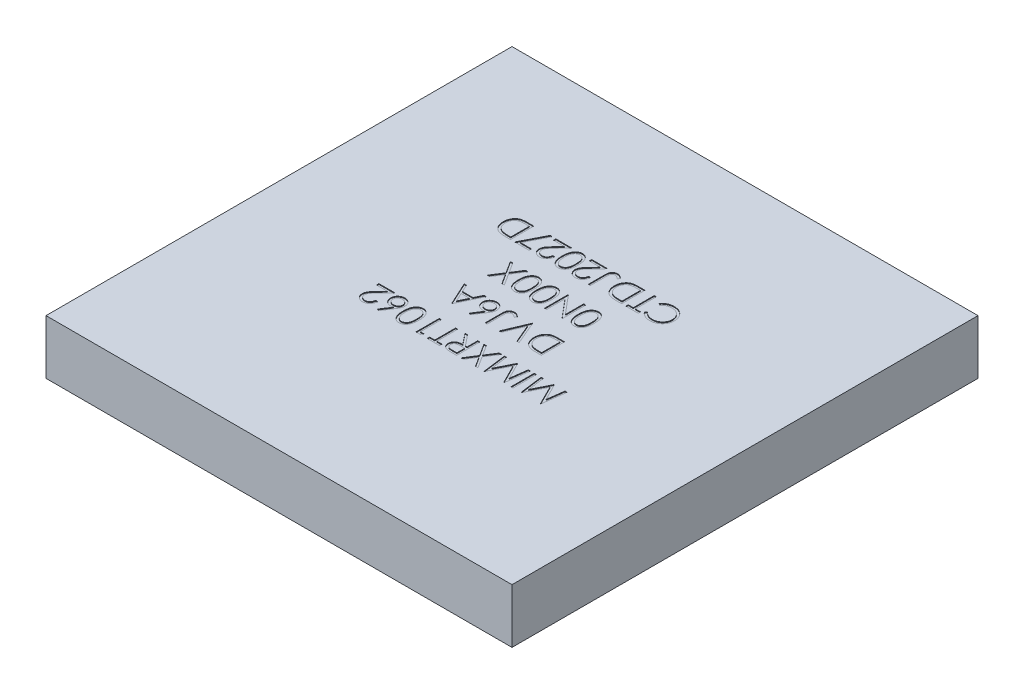
from build123d import *

# Parameters (mm, degrees)
BASES_W          = 12
BASES_H          = 12
BASE_DEPTH       = 1.4
PARTNUMBERS_W    = 0.053846154
PARTNUMBERS_H    = 0.6
PARTNUMBER_DEPTH = 0.02


with BuildPart() as part:
    # BaseS → Base (new body)
    with BuildSketch(Plane(origin=(0, 0, 0), x_dir=(1, 0, 0), z_dir=(0, 1, 0))):
        Rectangle(BASES_W, BASES_H)
    extrude(amount=BASE_DEPTH)

    # PartNumberS → PartNumber (cut)
    # profile 1 of 29: a face of its own
    with BuildSketch(Plane(origin=(0, 1.4, 0), x_dir=(1, 0, 0), z_dir=(0, 1, 0))):
        Polygon((2.419230769, -1), (2.340024038, -1.6), (2.332331731, -1.6), (2.084615385, -1.107692308), (1.8375, -1.6), (1.8296875, -1.6), (1.75, -1), (1.804086538, -1), (1.861538462, -1.431730769), (2.078125, -1), (2.090264423, -1), (2.307692308, -1.432692308), (2.365024038, -1), align=None)
    # profile 2 of 29: a face of its own
    with BuildSketch(Plane(origin=(0, 1.4, 0), x_dir=(1, 0, 0), z_dir=(0, 1, 0))):
        with Locations((1.6, -1.3)):
            Rectangle(PARTNUMBERS_W, PARTNUMBERS_H)
    # profile 3 of 29: a face of its own
    with BuildSketch(Plane(origin=(0, 1.4, 0), x_dir=(1, 0, 0), z_dir=(0, 1, 0))):
        Polygon((1.473076923, -1), (1.393870192, -1.6), (1.386177885, -1.6), (1.138461538, -1.107692308), (0.891346154, -1.6), (0.883533654, -1.6), (0.803846154, -1), (0.857932692, -1), (0.915384615, -1.431730769), (1.131971154, -1), (1.144110577, -1), (1.361538462, -1.432692308), (1.418870192, -1), align=None)
    # profile 4 of 29: a face of its own
    with BuildSketch(Plane(origin=(0, 1.4, 0), x_dir=(1, 0, 0), z_dir=(0, 1, 0))):
        Polygon((0.723076923, -1.6), (0.6609375, -1.6), (0.503846154, -1.354567308), (0.346754808, -1.6), (0.284615385, -1.6), (0.472716346, -1.306009615), (0.276923077, -1), (0.3390625, -1), (0.503846154, -1.257451923), (0.668629808, -1), (0.730769231, -1), (0.534855769, -1.306009615), align=None)
    # profile 5 of 29: a face of its own
    with BuildSketch(Plane(origin=(0, 1.4, 0), x_dir=(1, 0, 0), z_dir=(0, 1, 0))):
        with BuildLine():
            Line((0.173076923, -1.6), (0.053004808, -1.6))
            add(Edge.make_bspline(
                [(0.053004808, -1.6), (0.044992043, -1.599973328), (0.029606647, -1.599922115), (0.007565515, -1.599636556), (-0.012461988, -1.598818095), (-0.030465389, -1.598113766), (-0.046444358, -1.596829433), (-0.060447894, -1.595601894), (-0.072411499, -1.593994981), (-0.079653645, -1.592502622), (-0.082932692, -1.591826923)],
                knots=[0, 0, 0, 0, 1.410062039, 2.707475311, 3.878576406, 4.937260626, 5.877586885, 6.699081471, 7.410979367, 8, 8, 8, 8], degree=3))
            add(Edge.make_bspline(
                [(-0.082932692, -1.591826923), (-0.087322473, -1.590742455), (-0.096008389, -1.588596653), (-0.108513042, -1.584058979), (-0.12043374, -1.578816329), (-0.131726827, -1.572611609), (-0.142389345, -1.565549595), (-0.15242022, -1.557601896), (-0.161684957, -1.548700418), (-0.170513181, -1.539213894), (-0.178221907, -1.528729293), (-0.185161805, -1.517778681), (-0.190987612, -1.506151231), (-0.195571872, -1.493905589), (-0.199414992, -1.481161879), (-0.201997927, -1.467794176), (-0.203606624, -1.453845971), (-0.203765563, -1.444355464), (-0.203846154, -1.439543269)],
                knots=[0, 0, 0, 0, 1.027276577, 2.032638556, 3.019345632, 3.985365262, 4.957888996, 5.923693931, 6.890056973, 7.876427719, 8.865527834, 9.843495157, 10.821038291, 11.815616373, 12.812734995, 13.843357168, 14.906466538, 16, 16, 16, 16], degree=3))
            add(Edge.make_bspline(
                [(-0.203846154, -1.439543269), (-0.203594332, -1.431548671), (-0.203102963, -1.415949138), (-0.198521425, -1.393310258), (-0.191017213, -1.37219162), (-0.180674848, -1.352622614), (-0.167510346, -1.334974382), (-0.151689609, -1.319525792), (-0.133293432, -1.306478754), (-0.116087394, -1.297527337), (-0.100881271, -1.291767611), (-0.088325899, -1.287694702), (-0.074619711, -1.284600935), (-0.059959343, -1.281789133), (-0.044231557, -1.279643502), (-0.027468024, -1.278119696), (-0.009626818, -1.277139877), (0.002602855, -1.276996721), (0.008894231, -1.276923077)],
                knots=[0, 0, 0, 0, 1.260402266, 2.459371274, 3.627181936, 4.786749125, 5.93865593, 7.087644312, 8.261344208, 9.485713728, 10.136162886, 10.825977872, 11.566646758, 12.35154167, 13.181268117, 14.0701832, 15.007234106, 16, 16, 16, 16], degree=3))
            Line((0.008894231, -1.276923077), (-0.211538462, -1))
            Line((-0.211538462, -1), (-0.144951923, -1))
            Line((-0.144951923, -1), (0.075480769, -1.276923077))
            Line((0.075480769, -1.276923077), (0.119230769, -1.276923077))
            Line((0.119230769, -1.276923077), (0.119230769, -1))
            Line((0.119230769, -1), (0.173076923, -1))
            Line((0.173076923, -1), (0.173076923, -1.6))
        make_face()
        with BuildLine():
            Line((0.119230769, -1.538461538), (0.119230769, -1.338461538))
            Line((0.119230769, -1.338461538), (0.009375, -1.337620192))
            add(Edge.make_bspline(
                [(0.009375, -1.337620192), (0.00424585, -1.337617922), (-0.005695904, -1.337613521), (-0.020078866, -1.338298186), (-0.033470915, -1.339076981), (-0.045820659, -1.340268497), (-0.05713417, -1.341803166), (-0.067403976, -1.343725824), (-0.07665277, -1.345956326), (-0.087405223, -1.34944389), (-0.099550136, -1.354731055), (-0.112476763, -1.362929265), (-0.123780727, -1.372843792), (-0.133178726, -1.384324282), (-0.140727209, -1.397001115), (-0.145970303, -1.410587396), (-0.149425471, -1.424869061), (-0.149806282, -1.434675138), (-0.15, -1.439663462)],
                knots=[0, 0, 0, 0, 1.146399208, 2.222048177, 3.218135709, 4.144938032, 4.994811973, 5.769438708, 6.479732432, 7.119818093, 8.294689872, 9.430121864, 10.527913442, 11.641375077, 12.733452768, 13.811150417, 14.886538365, 16, 16, 16, 16], degree=3))
            add(Edge.make_bspline(
                [(-0.15, -1.439663462), (-0.149796474, -1.444489532), (-0.149393159, -1.454053043), (-0.146025316, -1.468022266), (-0.140526163, -1.481305163), (-0.132999234, -1.493718954), (-0.123631163, -1.504903955), (-0.11271947, -1.514444777), (-0.100520932, -1.522371019), (-0.089212094, -1.527600774), (-0.079030156, -1.530677969), (-0.070230463, -1.532911702), (-0.060200874, -1.534476107), (-0.049059435, -1.535914942), (-0.036757202, -1.537133415), (-0.023286679, -1.537942177), (-0.008657498, -1.538425576), (0.001481974, -1.538449272), (0.006730769, -1.538461538)],
                knots=[0, 0, 0, 0, 1.100596872, 2.180981401, 3.259506136, 4.371595435, 5.481727359, 6.576991111, 7.667816242, 8.793363246, 9.406619729, 10.09427138, 10.864108636, 11.721733836, 12.6590937, 13.685439239, 14.801845161, 16, 16, 16, 16], degree=3))
            Line((0.006730769, -1.538461538), (0.119230769, -1.538461538))
        make_face(mode=Mode.SUBTRACT)
    # profile 6 of 29: a face of its own
    with BuildSketch(Plane(origin=(0, 1.4, 0), x_dir=(1, 0, 0), z_dir=(0, 1, 0))):
        Polygon((-0.265384615, -1.538461538), (-0.265384615, -1.6), (-0.580769231, -1.6), (-0.580769231, -1.538461538), (-0.45, -1.538461538), (-0.45, -1), (-0.396153846, -1), (-0.396153846, -1.538461538), align=None)
    # profile 7 of 29: a face of its own
    with BuildSketch(Plane(origin=(0, 1.4, 0), x_dir=(1, 0, 0), z_dir=(0, 1, 0))):
        Polygon((-0.762139423, -1.6), (-0.873076923, -1.6), (-0.873076923, -1), (-0.819230769, -1), (-0.819230769, -1.538461538), (-0.726923077, -1.538461538), align=None)
    # profile 8 of 29: a face of its own
    with BuildSketch(Plane(origin=(0, 1.4, 0), x_dir=(1, 0, 0), z_dir=(0, 1, 0))):
        with BuildLine():
            add(Edge.make_bspline(
                [(-1.096153846, -1.299759615), (-1.096210078, -1.30937631), (-1.096319309, -1.328056879), (-1.097534467, -1.355277103), (-1.099553097, -1.380813153), (-1.102319504, -1.40466625), (-1.105686013, -1.426842554), (-1.110180103, -1.447282792), (-1.115290848, -1.466081602), (-1.121214195, -1.483300172), (-1.127897573, -1.499170865), (-1.135172872, -1.513985804), (-1.143323808, -1.527727292), (-1.151902108, -1.540597792), (-1.161207999, -1.552467781), (-1.171209117, -1.563283912), (-1.181817374, -1.573213797), (-1.193082963, -1.582094152), (-1.204898511, -1.589832196), (-1.216914497, -1.596846558), (-1.229473642, -1.602395113), (-1.242266168, -1.607139765), (-1.255395142, -1.610898172), (-1.268866283, -1.613512438), (-1.282691679, -1.615147979), (-1.292022623, -1.615304988), (-1.296754808, -1.615384615)],
                knots=[0, 0, 0, 0, 1.64625301, 3.197870201, 4.6634513, 6.030635694, 7.308242971, 8.501545196, 9.611429483, 10.641742253, 11.616230371, 12.55791849, 13.464870342, 14.34944951, 15.20427819, 16.044004467, 16.869007726, 17.689551165, 18.496129964, 19.285613293, 20.0683943, 20.843080271, 21.620342827, 22.403213977, 23.190190624, 24, 24, 24, 24], degree=3))
            add(Edge.make_bspline(
                [(-1.296754808, -1.615384615), (-1.301528918, -1.615318401), (-1.311027718, -1.615186658), (-1.3250206, -1.613332295), (-1.338769751, -1.610938815), (-1.352066567, -1.607100066), (-1.365162467, -1.602506506), (-1.377731781, -1.596445377), (-1.390218274, -1.589853428), (-1.402054699, -1.581811804), (-1.413594709, -1.572924487), (-1.424412263, -1.56283511), (-1.434783887, -1.551822898), (-1.444317849, -1.539642246), (-1.453422761, -1.526479919), (-1.461752992, -1.512225581), (-1.469481796, -1.496910819), (-1.476754452, -1.480606631), (-1.483114198, -1.462877507), (-1.488768521, -1.443834029), (-1.493403195, -1.423303747), (-1.497235989, -1.40140103), (-1.500210967, -1.378017371), (-1.502376105, -1.353200148), (-1.503520193, -1.326933835), (-1.503735609, -1.308975341), (-1.503846154, -1.299759615)],
                knots=[0, 0, 0, 0, 0.810910589, 1.61342667, 2.396193133, 3.181089899, 3.963115317, 4.752255436, 5.550715454, 6.36105385, 7.181178335, 8.024612154, 8.872680183, 9.750181803, 10.651284446, 11.591556747, 12.554036451, 13.566402641, 14.62422919, 15.753422176, 16.94128843, 18.199818041, 19.531985927, 20.947085226, 22.433341622, 24, 24, 24, 24], degree=3))
            add(Edge.make_bspline(
                [(-1.503846154, -1.299759615), (-1.503733039, -1.290584203), (-1.503512147, -1.272666267), (-1.502402143, -1.246516435), (-1.500152927, -1.221834633), (-1.497411538, -1.198585102), (-1.493458993, -1.176798234), (-1.489058628, -1.156357023), (-1.483445717, -1.137453541), (-1.477236822, -1.119876387), (-1.47006536, -1.103641266), (-1.462394764, -1.088389718), (-1.453940181, -1.074216276), (-1.445009975, -1.06097052), (-1.435295516, -1.048894332), (-1.425064251, -1.037758935), (-1.41414175, -1.027652029), (-1.402542336, -1.018659777), (-1.390594035, -1.010557577), (-1.378105108, -1.003730579), (-1.36536791, -0.997778829), (-1.352249958, -0.992994319), (-1.338834901, -0.989212145), (-1.325074428, -0.98663745), (-1.311025846, -0.984822614), (-1.301528292, -0.9846847), (-1.296754808, -0.984615385)],
                knots=[0, 0, 0, 0, 1.561431216, 3.049195289, 4.452146966, 5.778046447, 7.031138842, 8.218704273, 9.334037798, 10.384210803, 11.388620812, 12.352076869, 13.287433199, 14.19507451, 15.06813243, 15.922055533, 16.766344942, 17.596869952, 18.417486629, 19.220035357, 20.016159057, 20.807716045, 21.59340902, 22.384936649, 23.188266813, 24, 24, 24, 24], degree=3))
            add(Edge.make_bspline(
                [(-1.296754808, -0.984615385), (-1.292022788, -0.984695717), (-1.282692169, -0.984854118), (-1.268864391, -0.986479466), (-1.255412782, -0.98912986), (-1.242310453, -0.992729082), (-1.22953059, -0.997303481), (-1.217198375, -1.003121941), (-1.205150986, -1.009870475), (-1.19344322, -1.017548097), (-1.182298894, -1.026346826), (-1.171651575, -1.036076548), (-1.161779949, -1.046988008), (-1.152538236, -1.058907051), (-1.143888759, -1.071809951), (-1.13577234, -1.085656638), (-1.128519197, -1.1006159), (-1.121684281, -1.116572748), (-1.11565925, -1.133917836), (-1.110398304, -1.152781066), (-1.105962848, -1.173291104), (-1.102429945, -1.19544893), (-1.09953571, -1.219220244), (-1.097536457, -1.244642926), (-1.096319916, -1.271662523), (-1.096210213, -1.29022301), (-1.096153846, -1.299759615)],
                knots=[0, 0, 0, 0, 0.810976328, 1.599087026, 2.383086309, 3.159618043, 3.926613167, 4.707144544, 5.494386734, 6.292609454, 7.104690378, 7.92621526, 8.762510248, 9.62398222, 10.509836085, 11.424023232, 12.373226806, 13.358118208, 14.398657954, 15.5185989, 16.713620699, 17.994156382, 19.364120462, 20.818119981, 22.365111093, 24, 24, 24, 24], degree=3))
        make_face()
        with BuildLine():
            add(Edge.make_bspline(
                [(-1.15, -1.3), (-1.150020926, -1.291985969), (-1.150061538, -1.27643231), (-1.151091808, -1.253870111), (-1.152525839, -1.232790991), (-1.154329932, -1.213203177), (-1.157031816, -1.195175125), (-1.160097276, -1.178631895), (-1.163774084, -1.16360408), (-1.168145938, -1.149960445), (-1.173125642, -1.137507491), (-1.178553961, -1.125914333), (-1.184434004, -1.115039956), (-1.190900676, -1.104923596), (-1.198046626, -1.095621755), (-1.205712354, -1.087090255), (-1.213942434, -1.079363834), (-1.225332849, -1.070194138), (-1.240297168, -1.060606891), (-1.259247982, -1.052360947), (-1.278729381, -1.047145402), (-1.291955918, -1.046483982), (-1.298557692, -1.046153846)],
                knots=[0, 0, 0, 0, 1.459193451, 2.832007961, 4.111736495, 5.306635028, 6.412683014, 7.430020708, 8.369596877, 9.227877302, 10.036669781, 10.810175692, 11.557788084, 12.286326232, 12.994037279, 13.69140682, 14.37267704, 15.047194847, 16.352618509, 17.594157723, 18.799169539, 20, 20, 20, 20], degree=3))
            add(Edge.make_bspline(
                [(-1.298557692, -1.046153846), (-1.305197375, -1.04644333), (-1.318453189, -1.04702127), (-1.337921328, -1.052065304), (-1.356664725, -1.060265302), (-1.371456816, -1.069633606), (-1.382679147, -1.078612467), (-1.390722729, -1.086258984), (-1.398104609, -1.094823322), (-1.405106159, -1.104063069), (-1.4115277, -1.114155532), (-1.4173671, -1.125051963), (-1.422695672, -1.136782682), (-1.425731509, -1.14497178), (-1.427283654, -1.149158654)],
                knots=[0, 0, 0, 0, 1.353621445, 2.702441307, 4.075953605, 5.516772412, 6.261413105, 7.007624062, 7.778524365, 8.566925914, 9.372323995, 10.217594641, 11.088702136, 12, 12, 12, 12], degree=3))
            add(Edge.make_bspline(
                [(-1.427283654, -1.149158654), (-1.429092528, -1.154512323), (-1.432765319, -1.165382569), (-1.437498766, -1.182244909), (-1.441226549, -1.199936812), (-1.444580269, -1.218352546), (-1.446869364, -1.237627923), (-1.448711846, -1.257703303), (-1.449797107, -1.278593822), (-1.449931636, -1.29278725), (-1.45, -1.3)],
                knots=[0, 0, 0, 0, 0.884706709, 1.796334032, 2.740027952, 3.714592787, 4.726048262, 5.777819803, 6.87074269, 8, 8, 8, 8], degree=3))
            add(Edge.make_bspline(
                [(-1.45, -1.3), (-1.449924602, -1.307212595), (-1.449777088, -1.321323719), (-1.44880791, -1.341968306), (-1.447250522, -1.361610479), (-1.44514263, -1.380268057), (-1.442248942, -1.397907831), (-1.438773909, -1.414555042), (-1.434699837, -1.43020521), (-1.430026733, -1.444898667), (-1.424760286, -1.458582699), (-1.418942181, -1.471286762), (-1.412734371, -1.483079375), (-1.40598735, -1.493922607), (-1.398796578, -1.503879731), (-1.390903859, -1.512721539), (-1.382810533, -1.52087816), (-1.37130011, -1.530022334), (-1.356353477, -1.539419481), (-1.337626525, -1.547832062), (-1.318244936, -1.552810855), (-1.305115375, -1.553501303), (-1.298557692, -1.553846154)],
                knots=[0, 0, 0, 0, 1.313528337, 2.569860077, 3.762944266, 4.901481389, 5.988248151, 7.017139294, 7.997571128, 8.932104357, 9.823695246, 10.66607014, 11.475539426, 12.248954257, 12.990316782, 13.708962568, 14.405488541, 15.08007697, 16.381737273, 17.610043218, 18.806313575, 20, 20, 20, 20], degree=3))
            add(Edge.make_bspline(
                [(-1.298557692, -1.553846154), (-1.291920304, -1.553500895), (-1.278633435, -1.552809748), (-1.259049092, -1.547849628), (-1.240210032, -1.539479314), (-1.225294897, -1.530010713), (-1.213946517, -1.520913672), (-1.205870808, -1.51314954), (-1.198249445, -1.504697827), (-1.191137728, -1.495438161), (-1.184710511, -1.485341091), (-1.178759002, -1.474545547), (-1.173373992, -1.46296961), (-1.168375492, -1.45052354), (-1.164050026, -1.436857485), (-1.160160927, -1.421832667), (-1.157159129, -1.405181849), (-1.154493795, -1.387069138), (-1.152479106, -1.367458035), (-1.151101802, -1.346329016), (-1.150058409, -1.323688167), (-1.15001986, -1.308054203), (-1.15, -1.3)],
                knots=[0, 0, 0, 0, 1.207779899, 2.417760083, 3.652287919, 4.947299644, 5.621638849, 6.297435916, 6.984320042, 7.691843698, 8.42018894, 9.161205785, 9.934506883, 10.743085206, 11.601138371, 12.542248028, 13.566483018, 14.679455109, 15.87477181, 17.154161492, 18.533899613, 20, 20, 20, 20], degree=3))
        make_face(mode=Mode.SUBTRACT)
    # profile 9 of 29: a face of its own
    with BuildSketch(Plane(origin=(0, 1.4, 0), x_dir=(1, 0, 0), z_dir=(0, 1, 0))):
        with BuildLine():
            Line((-1.834615385, -1.615384615), (-1.876081731, -1.5828125))
            Line((-1.876081731, -1.5828125), (-1.717548077, -1.340384615))
            add(Edge.make_bspline(
                [(-1.717548077, -1.340384615), (-1.728102982, -1.342066991), (-1.748691516, -1.345348656), (-1.769531385, -1.345890018), (-1.7796875, -1.346153846)],
                knots=[0, 0, 0, 0, 1.025318673, 2, 2, 2, 2], degree=3))
            add(Edge.make_bspline(
                [(-1.7796875, -1.346153846), (-1.785785642, -1.345989941), (-1.797789654, -1.345667299), (-1.815413677, -1.343184354), (-1.832348924, -1.339271478), (-1.848525198, -1.333567661), (-1.864000575, -1.326281547), (-1.878863809, -1.317549154), (-1.892835712, -1.306919667), (-1.906095414, -1.295045453), (-1.918136206, -1.281894795), (-1.928788228, -1.267937294), (-1.93778475, -1.253174054), (-1.944952329, -1.237608394), (-1.950680494, -1.22136216), (-1.954758251, -1.204371991), (-1.957195995, -1.186609211), (-1.957525121, -1.174526878), (-1.957692308, -1.168389423)],
                knots=[0, 0, 0, 0, 1.043709831, 2.054511743, 3.041122595, 4.01515914, 4.98481438, 5.965901842, 6.960491961, 7.985277438, 9.0096037, 10.00832444, 10.987059228, 11.962929573, 12.936966118, 13.931840027, 14.949438142, 16, 16, 16, 16], degree=3))
            add(Edge.make_bspline(
                [(-1.957692308, -1.168389423), (-1.957379777, -1.159997583), (-1.956765153, -1.143494164), (-1.952274129, -1.119361903), (-1.944580767, -1.09656972), (-1.934122542, -1.075058102), (-1.920812187, -1.055277547), (-1.904847421, -1.037460676), (-1.886307065, -1.021930781), (-1.865560266, -1.008614168), (-1.843108821, -0.998032614), (-1.819566946, -0.990209844), (-1.795136837, -0.985535453), (-1.778545397, -0.984923485), (-1.770192308, -0.984615385)],
                knots=[0, 0, 0, 0, 1.0319111, 2.029359566, 3.00642934, 3.98275322, 4.962714161, 5.929339302, 6.915525103, 7.928435063, 8.953439721, 9.960121214, 10.9730072, 12, 12, 12, 12], degree=3))
            add(Edge.make_bspline(
                [(-1.770192308, -0.984615385), (-1.762118246, -0.984876618), (-1.746124944, -0.985394074), (-1.722604315, -0.990027705), (-1.699963728, -0.997484559), (-1.678494326, -1.007973313), (-1.658571646, -1.02099746), (-1.64061094, -1.036570039), (-1.625066677, -1.054701149), (-1.612083322, -1.075052459), (-1.60145858, -1.096748809), (-1.594034916, -1.119618062), (-1.58920826, -1.143186259), (-1.588711559, -1.159231252), (-1.588461538, -1.167307692)],
                knots=[0, 0, 0, 0, 1.01206923, 2.004731945, 2.994948482, 3.995280086, 4.993424783, 5.973125358, 6.967517142, 7.97830003, 8.994392566, 9.989381197, 10.98793077, 12, 12, 12, 12], degree=3))
            add(Edge.make_bspline(
                [(-1.588461538, -1.167307692), (-1.588678987, -1.173484514), (-1.589122777, -1.186090791), (-1.591771266, -1.205238581), (-1.596628919, -1.224754106), (-1.601885961, -1.241297932), (-1.607102534, -1.254999218), (-1.61193946, -1.265818761), (-1.617347732, -1.277244546), (-1.623686981, -1.289060386), (-1.630407097, -1.301603885), (-1.638256954, -1.314410518), (-1.646448401, -1.327948024), (-1.652449246, -1.336961085), (-1.655528846, -1.341586538)],
                knots=[0, 0, 0, 0, 1.17367173, 2.395347028, 3.66355231, 4.98980831, 5.690886799, 6.447442954, 7.240630024, 8.091733897, 8.994365608, 9.943299771, 10.944512865, 12, 12, 12, 12], degree=3))
            Line((-1.655528846, -1.341586538), (-1.834615385, -1.615384615))
        make_face()
        with BuildLine():
            add(Edge.make_bspline(
                [(-1.768389423, -1.284615385), (-1.763818444, -1.284481537), (-1.75485022, -1.28421893), (-1.741716816, -1.282703018), (-1.729279463, -1.279928477), (-1.717558572, -1.276023034), (-1.706381164, -1.271251593), (-1.695924783, -1.265200816), (-1.686119058, -1.258085233), (-1.677190434, -1.249895294), (-1.668989602, -1.241065356), (-1.661936089, -1.231549482), (-1.655844952, -1.221640241), (-1.6508942, -1.211244014), (-1.647038647, -1.200367597), (-1.644249834, -1.189060263), (-1.642697754, -1.177246391), (-1.642439544, -1.169235103), (-1.642307692, -1.165144231)],
                knots=[0, 0, 0, 0, 1.129540697, 2.216149546, 3.260829642, 4.271906843, 5.264942922, 6.258225651, 7.250175744, 8.252297429, 9.247108021, 10.223125336, 11.173816288, 12.116901384, 13.062424938, 14.020354563, 14.989116641, 16, 16, 16, 16], degree=3))
            add(Edge.make_bspline(
                [(-1.642307692, -1.165144231), (-1.642419147, -1.161090811), (-1.642638783, -1.153103049), (-1.644500156, -1.141375177), (-1.647496389, -1.130125263), (-1.651755754, -1.119329577), (-1.657197205, -1.109004533), (-1.663705467, -1.099025314), (-1.671597296, -1.089657555), (-1.68056258, -1.08084344), (-1.690304395, -1.072777804), (-1.70058563, -1.065566648), (-1.711443176, -1.059581246), (-1.722761403, -1.0545783), (-1.734682502, -1.050902789), (-1.747004596, -1.048086928), (-1.759897486, -1.046547903), (-1.768626118, -1.046286922), (-1.773076923, -1.046153846)],
                knots=[0, 0, 0, 0, 0.98953633, 1.950002717, 2.892353065, 3.828177645, 4.777967117, 5.738732544, 6.732276577, 7.76327951, 8.805689376, 9.818183401, 10.825652611, 11.829169732, 12.834974292, 13.867693979, 14.912718532, 16, 16, 16, 16], degree=3))
            add(Edge.make_bspline(
                [(-1.773076923, -1.046153846), (-1.777527736, -1.046286912), (-1.786256382, -1.046547872), (-1.799149168, -1.048087044), (-1.811471646, -1.050902361), (-1.823391352, -1.054579849), (-1.834714743, -1.059575467), (-1.845581787, -1.065604377), (-1.855961189, -1.072734089), (-1.865696669, -1.080857387), (-1.874699366, -1.089607554), (-1.882409852, -1.099110944), (-1.889128004, -1.108925998), (-1.894361934, -1.119370645), (-1.898668989, -1.130118843), (-1.901650543, -1.141376929), (-1.903515884, -1.153102592), (-1.903734975, -1.161090657), (-1.903846154, -1.165144231)],
                knots=[0, 0, 0, 0, 1.087095469, 2.131941252, 3.164484274, 4.170116773, 5.173462224, 6.180759088, 7.201132453, 8.243363996, 9.274190558, 10.261329848, 11.227346438, 12.172477233, 13.108141724, 14.050330866, 15.010632948, 16, 16, 16, 16], degree=3))
            add(Edge.make_bspline(
                [(-1.903846154, -1.165144231), (-1.903752917, -1.169240915), (-1.903569925, -1.177281374), (-1.901460095, -1.189049619), (-1.898610419, -1.200459544), (-1.894005078, -1.211254113), (-1.888519752, -1.221731873), (-1.881531765, -1.231593235), (-1.873520026, -1.241118067), (-1.864241036, -1.249953823), (-1.854148656, -1.258041428), (-1.84340758, -1.265159196), (-1.832215701, -1.271235143), (-1.820414823, -1.2760295), (-1.80816387, -1.2798919), (-1.795378207, -1.282684434), (-1.782048753, -1.28422129), (-1.773000526, -1.284482347), (-1.768389423, -1.284615385)],
                knots=[0, 0, 0, 0, 0.978317929, 1.920119929, 2.851929572, 3.784133089, 4.71845084, 5.67514162, 6.667477147, 7.690549442, 8.733345855, 9.756283585, 10.767808623, 11.772962645, 12.797066014, 13.836159554, 14.89727653, 16, 16, 16, 16], degree=3))
        make_face(mode=Mode.SUBTRACT)
    # profile 10 of 29: a face of its own
    with BuildSketch(Plane(origin=(0, 1.4, 0), x_dir=(1, 0, 0), z_dir=(0, 1, 0))):
        with BuildLine():
            Line((-2.096153846, -1.415384615), (-2.042307692, -1.415384615))
            add(Edge.make_bspline(
                [(-2.042307692, -1.415384615), (-2.042658573, -1.422528231), (-2.043347694, -1.436558103), (-2.046576246, -1.457013132), (-2.051191623, -1.476567186), (-2.057732688, -1.495052627), (-2.065810333, -1.512690277), (-2.075699708, -1.52924593), (-2.087189987, -1.544883898), (-2.100260092, -1.559308103), (-2.11444236, -1.57249363), (-2.129651818, -1.584000501), (-2.145732141, -1.593611447), (-2.162543855, -1.601689669), (-2.180281393, -1.607745992), (-2.198775203, -1.612241659), (-2.218108877, -1.614946031), (-2.231281437, -1.615236757), (-2.237980769, -1.615384615)],
                knots=[0, 0, 0, 0, 1.100776268, 2.161895295, 3.184016182, 4.190939212, 5.176500551, 6.166955529, 7.155448256, 8.160289653, 9.16017456, 10.133824356, 11.091467644, 12.04088621, 13.000931625, 13.972173743, 14.968683325, 16, 16, 16, 16], degree=3))
            add(Edge.make_bspline(
                [(-2.237980769, -1.615384615), (-2.244560331, -1.615231844), (-2.257488934, -1.614931654), (-2.276350158, -1.612314939), (-2.294348289, -1.608305056), (-2.311279355, -1.602363041), (-2.327317116, -1.594907113), (-2.342262997, -1.585634688), (-2.356478406, -1.574984508), (-2.369265676, -1.562422099), (-2.381012325, -1.549017977), (-2.391137227, -1.534702486), (-2.399856872, -1.519899829), (-2.406993629, -1.504494373), (-2.412403608, -1.488435953), (-2.416411884, -1.471878524), (-2.418703232, -1.454631004), (-2.419052963, -1.442955258), (-2.419230769, -1.437019231)],
                knots=[0, 0, 0, 0, 1.111674182, 2.184400057, 3.212814286, 4.223731311, 5.211378316, 6.196328225, 7.191884489, 8.207283132, 9.220262353, 10.201199469, 11.166417575, 12.120932471, 13.06540007, 14.026332106, 14.996573967, 16, 16, 16, 16], degree=3))
            add(Edge.make_bspline(
                [(-2.419230769, -1.437019231), (-2.418940491, -1.428662463), (-2.418365029, -1.412095576), (-2.413442631, -1.387750118), (-2.405754403, -1.364162876), (-2.396498534, -1.345178691), (-2.387158564, -1.329882969), (-2.378750314, -1.317283009), (-2.368851087, -1.30371981), (-2.357545458, -1.289138475), (-2.344638727, -1.273729958), (-2.330466211, -1.257179885), (-2.314661898, -1.239794278), (-2.303579276, -1.227911939), (-2.297836538, -1.221754808)],
                knots=[0, 0, 0, 0, 1.184416499, 2.348048165, 3.509039915, 4.696071444, 5.333504901, 6.05069495, 6.844171097, 7.714965912, 8.667477798, 9.695072654, 10.805644396, 12, 12, 12, 12], degree=3))
            Line((-2.297836538, -1.221754808), (-2.147716346, -1.061538462))
            Line((-2.147716346, -1.061538462), (-2.426923077, -1.061538462))
            Line((-2.426923077, -1.061538462), (-2.426923077, -1))
            Line((-2.426923077, -1), (-2.019230769, -1))
            Line((-2.019230769, -1), (-2.251923077, -1.248317308))
            add(Edge.make_bspline(
                [(-2.251923077, -1.248317308), (-2.25758883, -1.254230981), (-2.268471582, -1.265589936), (-2.283857604, -1.282178687), (-2.297698954, -1.29755023), (-2.310004814, -1.311772681), (-2.32078531, -1.32476541), (-2.330005948, -1.336630239), (-2.337707482, -1.347265348), (-2.345869503, -1.35975903), (-2.353652532, -1.375031178), (-2.360493018, -1.393600662), (-2.364634155, -1.412758764), (-2.365133461, -1.425701321), (-2.365384615, -1.432211538)],
                knots=[0, 0, 0, 0, 1.329530082, 2.553755191, 3.672934919, 4.687409497, 5.60679272, 6.413407421, 7.126401618, 7.737995624, 8.834647426, 9.90044882, 10.943907757, 12, 12, 12, 12], degree=3))
            add(Edge.make_bspline(
                [(-2.365384615, -1.432211538), (-2.36527675, -1.436305945), (-2.365064169, -1.444375234), (-2.363152502, -1.456198301), (-2.360343882, -1.467647249), (-2.356014932, -1.47858052), (-2.350813857, -1.489213149), (-2.344169101, -1.499221873), (-2.33657589, -1.508947863), (-2.327768137, -1.518057624), (-2.318098861, -1.52640358), (-2.307882372, -1.533796122), (-2.29707387, -1.539974297), (-2.285718397, -1.545038885), (-2.273847751, -1.54901181), (-2.261438936, -1.551764709), (-2.248526248, -1.553493135), (-2.239709077, -1.553726993), (-2.235216346, -1.553846154)],
                knots=[0, 0, 0, 0, 0.991504627, 1.954065223, 2.895985987, 3.842598665, 4.797835564, 5.759220273, 6.74786863, 7.784730864, 8.824135544, 9.839918996, 10.835834653, 11.835434876, 12.84861661, 13.863796685, 14.911511676, 16, 16, 16, 16], degree=3))
            add(Edge.make_bspline(
                [(-2.235216346, -1.553846154), (-2.230523005, -1.553728451), (-2.221306057, -1.553497301), (-2.207802618, -1.55174538), (-2.194830614, -1.549092184), (-2.182589942, -1.544868319), (-2.170824425, -1.539924836), (-2.159834208, -1.533523895), (-2.149310562, -1.52620983), (-2.139465068, -1.517682095), (-2.13049795, -1.508055567), (-2.122340483, -1.497577261), (-2.11542858, -1.486061418), (-2.109292953, -1.473784364), (-2.10460041, -1.460408799), (-2.100588622, -1.446261836), (-2.097674518, -1.431141634), (-2.096669156, -1.420724191), (-2.096153846, -1.415384615)],
                knots=[0, 0, 0, 0, 1.031072318, 2.024855787, 2.988461151, 3.935103592, 4.865765533, 5.788564469, 6.724086513, 7.67908574, 8.64457978, 9.611397706, 10.591395687, 11.591555111, 12.622101007, 13.700900657, 14.821571223, 16, 16, 16, 16], degree=3))
        make_face()
    # profile 11 of 29: a face of its own
    with BuildSketch(Plane(origin=(0, 1.4, 0), x_dir=(1, 0, 0), z_dir=(0, 1, 0))):
        with BuildLine():
            Line((1.261538462, 0.092307692), (1.261538462, -0.507692308))
            Line((1.261538462, -0.507692308), (1.140384615, -0.507692308))
            add(Edge.make_bspline(
                [(1.140384615, -0.507692308), (1.129847053, -0.507616645), (1.109488536, -0.507470466), (1.080069553, -0.506538315), (1.052888303, -0.50490599), (1.027960222, -0.50248245), (1.005245262, -0.499573524), (0.984779802, -0.495874096), (0.966530677, -0.491523318), (0.955307366, -0.487812495), (0.95, -0.486057692)],
                knots=[0, 0, 0, 0, 1.314317071, 2.539253741, 3.67075822, 4.709970291, 5.662644612, 6.526156501, 7.303037452, 8, 8, 8, 8], degree=3))
            add(Edge.make_bspline(
                [(0.95, -0.486057692), (0.943057424, -0.483413249), (0.929329706, -0.47818433), (0.90979464, -0.46830562), (0.891342188, -0.457158377), (0.874118052, -0.444487032), (0.858084278, -0.430453512), (0.843039128, -0.415171357), (0.829413842, -0.398232587), (0.816738481, -0.380162805), (0.805644251, -0.360797573), (0.795861273, -0.340524773), (0.787508094, -0.31938374), (0.780990371, -0.297220218), (0.775605606, -0.27424708), (0.77199256, -0.250290389), (0.769592559, -0.225489817), (0.769352549, -0.208659692), (0.769230769, -0.200120192)],
                knots=[0, 0, 0, 0, 0.984696416, 1.947063185, 2.89840987, 3.841051395, 4.778753227, 5.721858861, 6.681155121, 7.65838316, 8.646299769, 9.637283673, 10.641736726, 11.657050558, 12.698485921, 13.768600492, 14.86780186, 16, 16, 16, 16], degree=3))
            add(Edge.make_bspline(
                [(0.769230769, -0.200120192), (0.769338665, -0.192704005), (0.769551285, -0.178089634), (0.771458126, -0.156550835), (0.774235015, -0.13565268), (0.778514507, -0.115486933), (0.783773049, -0.095917823), (0.790263429, -0.077038005), (0.797956179, -0.05883465), (0.806877583, -0.04145234), (0.816646156, -0.024933343), (0.827290621, -0.009539392), (0.838446517, 0.004899238), (0.85052072, 0.018056361), (0.863113465, 0.030341696), (0.87665305, 0.041210264), (0.890715533, 0.051166635), (0.905723393, 0.059908451), (0.921799764, 0.067684556), (0.939364582, 0.074251524), (0.958353743, 0.079902889), (0.97889307, 0.084405509), (1.000914065, 0.08803485), (1.02447642, 0.090451805), (1.049536014, 0.092090802), (1.066743945, 0.092233992), (1.075600962, 0.092307692)],
                knots=[0, 0, 0, 0, 1.105894396, 2.179280415, 3.222964075, 4.248423888, 5.251546139, 6.243661943, 7.223682738, 8.196462441, 9.155694589, 10.083899862, 10.986397372, 11.874737962, 12.745335529, 13.607670254, 14.461432187, 15.313100333, 16.195087267, 17.121790994, 18.106827133, 19.14775296, 20.255889161, 21.433815148, 22.679170477, 24, 24, 24, 24], degree=3))
            Line((1.075600962, 0.092307692), (1.261538462, 0.092307692))
        make_face()
        with BuildLine():
            Line((1.207692308, 0.030769231), (1.138822115, 0.030769231))
            add(Edge.make_bspline(
                [(1.138822115, 0.030769231), (1.128925823, 0.0307267), (1.109891629, 0.030644898), (1.082521687, 0.029927091), (1.05751379, 0.028754188), (1.034864389, 0.027112746), (1.01458627, 0.024940983), (0.996637056, 0.022519571), (0.981075583, 0.019502866), (0.971659108, 0.016768415), (0.967307692, 0.015504808)],
                knots=[0, 0, 0, 0, 1.375205317, 2.645023457, 3.804390687, 4.853969522, 5.800190428, 6.637939096, 7.370582563, 8, 8, 8, 8], degree=3))
            add(Edge.make_bspline(
                [(0.967307692, 0.015504808), (0.961830714, 0.013576113), (0.951007574, 0.009764791), (0.935429643, 0.002809965), (0.920893662, -0.00541813), (0.907157301, -0.014618289), (0.894308841, -0.024932573), (0.882407781, -0.036393783), (0.871360117, -0.048869229), (0.861342733, -0.062400949), (0.852282804, -0.076838802), (0.844455055, -0.092166703), (0.837856351, -0.10829864), (0.832442553, -0.125178486), (0.828221648, -0.142816287), (0.825249964, -0.161256306), (0.823408446, -0.18049126), (0.823188636, -0.193585566), (0.823076923, -0.200240385)],
                knots=[0, 0, 0, 0, 0.998420628, 1.972994, 2.929372424, 3.86770908, 4.81360496, 5.759023883, 6.706048443, 7.676227424, 8.651287839, 9.634325482, 10.632389399, 11.645655052, 12.680158286, 13.74837235, 14.855672678, 16, 16, 16, 16], degree=3))
            add(Edge.make_bspline(
                [(0.823076923, -0.200240385), (0.823165009, -0.207257511), (0.823338055, -0.221042717), (0.825509464, -0.241270289), (0.828689405, -0.260721956), (0.833263502, -0.279411724), (0.839172842, -0.297315276), (0.846243845, -0.31453376), (0.854829153, -0.33084559), (0.86454863, -0.346388921), (0.875460522, -0.360928359), (0.887516426, -0.374293567), (0.900589219, -0.386509441), (0.914618652, -0.397595431), (0.929800881, -0.407354388), (0.945878992, -0.416035804), (0.963079468, -0.423412051), (0.975047584, -0.427333854), (0.981129808, -0.429326923)],
                knots=[0, 0, 0, 0, 1.122272916, 2.204715076, 3.251197285, 4.274229216, 5.279697671, 6.265416158, 7.248880903, 8.225321784, 9.195852973, 10.153576302, 11.101466393, 12.055578741, 13.010401466, 13.985536859, 14.976245305, 16, 16, 16, 16], degree=3))
            add(Edge.make_bspline(
                [(0.981129808, -0.429326923), (0.986161433, -0.430718311), (0.996860048, -0.433676783), (1.014318242, -0.436903989), (1.033966553, -0.439750475), (1.055892216, -0.442160424), (1.080070238, -0.44388968), (1.106519213, -0.445187619), (1.135250574, -0.446063042), (1.15516758, -0.44612282), (1.165504808, -0.446153846)],
                knots=[0, 0, 0, 0, 0.674548936, 1.434276114, 2.292660221, 3.240891867, 4.284742987, 5.42552168, 6.663806718, 8, 8, 8, 8], degree=3))
            Line((1.165504808, -0.446153846), (1.207692308, -0.446153846))
            Line((1.207692308, -0.446153846), (1.207692308, 0.030769231))
        make_face(mode=Mode.SUBTRACT)
    # profile 12 of 29: a face of its own
    with BuildSketch(Plane(origin=(0, 1.4, 0), x_dir=(1, 0, 0), z_dir=(0, 1, 0))):
        Polygon((0.692307692, -0.507692308), (0.634615385, -0.507692308), (0.434615385, -0.034855769), (0.234615385, -0.507692308), (0.176923077, -0.507692308), (0.430769231, 0.092307692), (0.438461538, 0.092307692), align=None)
    # profile 13 of 29: a face of its own
    with BuildSketch(Plane(origin=(0, 1.4, 0), x_dir=(1, 0, 0), z_dir=(0, 1, 0))):
        with BuildLine():
            Line((-0.130769231, -0.507692308), (-0.184615385, -0.507692308))
            Line((-0.184615385, -0.507692308), (-0.184615385, -0.102524038))
            add(Edge.make_bspline(
                [(-0.184615385, -0.102524038), (-0.184561814, -0.095031686), (-0.184458952, -0.080645454), (-0.183887552, -0.059924711), (-0.182844626, -0.040962524), (-0.181276786, -0.02380979), (-0.17940891, -0.008440007), (-0.177037448, 0.005169379), (-0.174216975, 0.017024062), (-0.169946342, 0.030328702), (-0.162984691, 0.044971927), (-0.152298744, 0.060644615), (-0.139304953, 0.074504356), (-0.124036377, 0.08629693), (-0.106820982, 0.096031529), (-0.087587515, 0.102834119), (-0.066688067, 0.107026949), (-0.052184055, 0.107466071), (-0.044711538, 0.107692308)],
                knots=[0, 0, 0, 0, 1.23761369, 2.376369303, 3.423688776, 4.373947637, 5.221061685, 5.980504468, 6.65465141, 7.232267317, 8.286152468, 9.319580031, 10.354278202, 11.410653829, 12.495036873, 13.606623453, 14.766924254, 16, 16, 16, 16], degree=3))
            add(Edge.make_bspline(
                [(-0.044711538, 0.107692308), (-0.038849984, 0.107509746), (-0.027136203, 0.107144913), (-0.009652104, 0.104095364), (0.007673537, 0.099304815), (0.025098743, 0.092418724), (0.042842105, 0.083094408), (0.06135924, 0.071047715), (0.080619362, 0.055959169), (0.093340865, 0.044473678), (0.1, 0.038461538)],
                knots=[0, 0, 0, 0, 0.854547984, 1.707735923, 2.581180402, 3.47327429, 4.435225703, 5.500268456, 6.691502816, 8, 8, 8, 8], degree=3))
            Line((0.1, 0.038461538), (0.068269231, -0.007692308))
            add(Edge.make_bspline(
                [(0.068269231, -0.007692308), (0.06093345, -0.002669584), (0.047093286, 0.006806616), (0.026967327, 0.019386498), (0.008798424, 0.029606402), (-0.002970811, 0.035003928), (-0.008413462, 0.0375)],
                knots=[0, 0, 0, 0, 1.196638425, 2.257656398, 3.194257951, 4, 4, 4, 4], degree=3))
            add(Edge.make_bspline(
                [(-0.008413462, 0.0375), (-0.011711143, 0.038864276), (-0.018156178, 0.041530636), (-0.028153314, 0.044079734), (-0.03795212, 0.045925557), (-0.04450288, 0.046078715), (-0.047716346, 0.046153846)],
                knots=[0, 0, 0, 0, 1.055403208, 2.062694816, 3.049657822, 4, 4, 4, 4], degree=3))
            add(Edge.make_bspline(
                [(-0.047716346, 0.046153846), (-0.05186217, 0.045980911), (-0.060017969, 0.045640708), (-0.07193797, 0.042554886), (-0.08330128, 0.03778634), (-0.093835462, 0.030954022), (-0.103427156, 0.022811853), (-0.111486792, 0.013096814), (-0.118034313, 0.002167979), (-0.122208998, -0.008088892), (-0.12472089, -0.017523177), (-0.126385748, -0.026154605), (-0.127590288, -0.036285905), (-0.128888228, -0.047852808), (-0.129587364, -0.06093484), (-0.130402815, -0.075471744), (-0.130693089, -0.091505389), (-0.130743076, -0.102684367), (-0.130769231, -0.108533654)],
                knots=[0, 0, 0, 0, 0.997338315, 1.961996122, 2.948199042, 3.955162468, 4.975046525, 5.968827587, 6.982064989, 8.034375777, 8.624523585, 9.332616724, 10.150461195, 11.082242492, 12.136676661, 13.306224245, 14.590509051, 16, 16, 16, 16], degree=3))
            Line((-0.130769231, -0.108533654), (-0.130769231, -0.507692308))
        make_face()
    # profile 14 of 29: a face of its own
    with BuildSketch(Plane(origin=(0, 1.4, 0), x_dir=(1, 0, 0), z_dir=(0, 1, 0))):
        with BuildLine():
            Line((-0.561538462, -0.523076923), (-0.603004808, -0.490504808))
            Line((-0.603004808, -0.490504808), (-0.444471154, -0.248076923))
            add(Edge.make_bspline(
                [(-0.444471154, -0.248076923), (-0.455026058, -0.249759299), (-0.475614593, -0.253040964), (-0.496454462, -0.253582326), (-0.506610577, -0.253846154)],
                knots=[0, 0, 0, 0, 1.025318673, 2, 2, 2, 2], degree=3))
            add(Edge.make_bspline(
                [(-0.506610577, -0.253846154), (-0.512708719, -0.253682249), (-0.524712731, -0.253359607), (-0.542336754, -0.250876661), (-0.559272001, -0.246963785), (-0.575448275, -0.241259969), (-0.590923652, -0.233973855), (-0.605786886, -0.225241462), (-0.619758789, -0.214611975), (-0.633018491, -0.20273776), (-0.645059283, -0.189587103), (-0.655711305, -0.175629602), (-0.664707827, -0.160866362), (-0.671875406, -0.145300701), (-0.677603571, -0.129054468), (-0.681681328, -0.112064298), (-0.684119072, -0.094301518), (-0.684448198, -0.082219185), (-0.684615385, -0.076081731)],
                knots=[0, 0, 0, 0, 1.043709831, 2.054511743, 3.041122595, 4.01515914, 4.98481438, 5.965901842, 6.960491961, 7.985277438, 9.0096037, 10.00832444, 10.987059228, 11.962929573, 12.936966118, 13.931840027, 14.949438142, 16, 16, 16, 16], degree=3))
            add(Edge.make_bspline(
                [(-0.684615385, -0.076081731), (-0.684302854, -0.06768989), (-0.68368823, -0.051186471), (-0.679197206, -0.027054211), (-0.671503844, -0.004262028), (-0.661045619, 0.01724959), (-0.647735264, 0.037030146), (-0.631770498, 0.054847017), (-0.613230141, 0.070376912), (-0.592483343, 0.083693525), (-0.570031898, 0.094275079), (-0.546490023, 0.102097848), (-0.522059914, 0.10677224), (-0.505468474, 0.107384208), (-0.497115385, 0.107692308)],
                knots=[0, 0, 0, 0, 1.0319111, 2.029359566, 3.00642934, 3.98275322, 4.962714161, 5.929339302, 6.915525103, 7.928435063, 8.953439721, 9.960121214, 10.9730072, 12, 12, 12, 12], degree=3))
            add(Edge.make_bspline(
                [(-0.497115385, 0.107692308), (-0.489041323, 0.107431075), (-0.473048021, 0.106913618), (-0.449527392, 0.102279987), (-0.426886804, 0.094823133), (-0.405417402, 0.08433438), (-0.385494723, 0.071310232), (-0.367534016, 0.055737654), (-0.351989754, 0.037606543), (-0.339006399, 0.017255233), (-0.328381657, -0.004441117), (-0.320957993, -0.027310369), (-0.316131337, -0.050878567), (-0.315634636, -0.066923559), (-0.315384615, -0.075)],
                knots=[0, 0, 0, 0, 1.01206923, 2.004731945, 2.994948482, 3.995280086, 4.993424783, 5.973125358, 6.967517142, 7.97830003, 8.994392566, 9.989381197, 10.98793077, 12, 12, 12, 12], degree=3))
            add(Edge.make_bspline(
                [(-0.315384615, -0.075), (-0.315602064, -0.081176822), (-0.316045854, -0.093783099), (-0.318694343, -0.112930888), (-0.323551996, -0.132446414), (-0.328809038, -0.14899024), (-0.33402561, -0.162691526), (-0.338862537, -0.173511069), (-0.344270809, -0.184936854), (-0.350610058, -0.196752694), (-0.357330174, -0.209296192), (-0.365180031, -0.222102826), (-0.373371478, -0.235640332), (-0.379372323, -0.244653393), (-0.382451923, -0.249278846)],
                knots=[0, 0, 0, 0, 1.17367173, 2.395347028, 3.66355231, 4.98980831, 5.690886799, 6.447442954, 7.240630024, 8.091733897, 8.994365608, 9.943299771, 10.944512865, 12, 12, 12, 12], degree=3))
            Line((-0.382451923, -0.249278846), (-0.561538462, -0.523076923))
        make_face()
        with BuildLine():
            add(Edge.make_bspline(
                [(-0.4953125, -0.192307692), (-0.490741521, -0.192173845), (-0.481773297, -0.191911238), (-0.468639893, -0.190395326), (-0.45620254, -0.187620784), (-0.444481649, -0.183715342), (-0.433304241, -0.178943901), (-0.42284786, -0.172893123), (-0.413042135, -0.165777541), (-0.404113511, -0.157587602), (-0.395912679, -0.148757663), (-0.388859166, -0.13924179), (-0.382768029, -0.129332549), (-0.377817277, -0.118936322), (-0.373961724, -0.108059904), (-0.371172911, -0.09675257), (-0.369620831, -0.084938698), (-0.369362621, -0.076927411), (-0.369230769, -0.072836538)],
                knots=[0, 0, 0, 0, 1.129540697, 2.216149546, 3.260829642, 4.271906843, 5.264942922, 6.258225651, 7.250175744, 8.252297429, 9.247108021, 10.223125336, 11.173816288, 12.116901384, 13.062424938, 14.020354563, 14.989116641, 16, 16, 16, 16], degree=3))
            add(Edge.make_bspline(
                [(-0.369230769, -0.072836538), (-0.369342224, -0.068783118), (-0.36956186, -0.060795357), (-0.371423233, -0.049067484), (-0.374419465, -0.037817571), (-0.378678831, -0.027021885), (-0.384120282, -0.016696841), (-0.390628544, -0.006717622), (-0.398520373, 0.002650138), (-0.407485657, 0.011464253), (-0.417227472, 0.019529888), (-0.427508707, 0.026741044), (-0.438366253, 0.032726446), (-0.44968448, 0.037729392), (-0.461605578, 0.041404904), (-0.473927673, 0.044220764), (-0.486820563, 0.045759789), (-0.495549195, 0.04602077), (-0.5, 0.046153846)],
                knots=[0, 0, 0, 0, 0.98953633, 1.950002717, 2.892353065, 3.828177645, 4.777967117, 5.738732544, 6.732276577, 7.76327951, 8.805689376, 9.818183401, 10.825652611, 11.829169732, 12.834974292, 13.867693979, 14.912718532, 16, 16, 16, 16], degree=3))
            add(Edge.make_bspline(
                [(-0.5, 0.046153846), (-0.504450813, 0.04602078), (-0.513179458, 0.04575982), (-0.526072245, 0.044220648), (-0.538394723, 0.041405331), (-0.550314429, 0.037727844), (-0.561637819, 0.032732225), (-0.572504864, 0.026703315), (-0.582884266, 0.019573604), (-0.592619746, 0.011450305), (-0.601622443, 0.002700138), (-0.609332929, -0.006803252), (-0.616051081, -0.016618306), (-0.621285011, -0.027062953), (-0.625592066, -0.037811151), (-0.62857362, -0.049069237), (-0.630438961, -0.0607949), (-0.630658052, -0.068782965), (-0.630769231, -0.072836538)],
                knots=[0, 0, 0, 0, 1.087095469, 2.131941252, 3.164484274, 4.170116773, 5.173462224, 6.180759088, 7.201132453, 8.243363996, 9.274190558, 10.261329848, 11.227346438, 12.172477233, 13.108141724, 14.050330866, 15.010632948, 16, 16, 16, 16], degree=3))
            add(Edge.make_bspline(
                [(-0.630769231, -0.072836538), (-0.630675994, -0.076933223), (-0.630493002, -0.084973681), (-0.628383171, -0.096741927), (-0.625533495, -0.108151851), (-0.620928155, -0.118946421), (-0.615442829, -0.12942418), (-0.608454842, -0.139285543), (-0.600443103, -0.148810375), (-0.591164113, -0.157646131), (-0.581071733, -0.165733736), (-0.570330657, -0.172851503), (-0.559138778, -0.178927451), (-0.5473379, -0.183721807), (-0.535086946, -0.187584208), (-0.522301284, -0.190376742), (-0.50897183, -0.191913598), (-0.499923603, -0.192174654), (-0.4953125, -0.192307692)],
                knots=[0, 0, 0, 0, 0.978317929, 1.920119929, 2.851929572, 3.784133089, 4.71845084, 5.67514162, 6.667477147, 7.690549442, 8.733345855, 9.756283585, 10.767808623, 11.772962645, 12.797066014, 13.836159554, 14.89727653, 16, 16, 16, 16], degree=3))
        make_face(mode=Mode.SUBTRACT)
    # profile 15 of 29: a face of its own
    with BuildSketch(Plane(origin=(0, 1.4, 0), x_dir=(1, 0, 0), z_dir=(0, 1, 0))):
        Polygon((-1.046153846, -0.507692308), (-1.323076923, 0.092307692), (-1.264543269, 0.092307692), (-1.175841346, -0.1), (-0.903846154, -0.1), (-0.812620192, 0.092307692), (-0.753846154, 0.092307692), (-1.038461538, -0.507692308), align=None)
        Polygon((-1.041706731, -0.390745192), (-0.933052885, -0.161538462), (-1.147475962, -0.161538462), align=None, mode=Mode.SUBTRACT)
    # profile 16 of 29: a face of its own
    with BuildSketch(Plane(origin=(0, 1.4, 0), x_dir=(1, 0, 0), z_dir=(0, 1, 0))):
        with BuildLine():
            add(Edge.make_bspline(
                [(1.230769231, 0.884855769), (1.230712999, 0.875239074), (1.230603768, 0.856558505), (1.22938861, 0.829338281), (1.22736998, 0.803802231), (1.224603573, 0.779949135), (1.221237064, 0.757772831), (1.216742974, 0.737332593), (1.211632229, 0.718533783), (1.205708882, 0.701315213), (1.199025504, 0.68544452), (1.191750205, 0.670629581), (1.183599269, 0.656888093), (1.175020969, 0.644017592), (1.165715078, 0.632147603), (1.15571396, 0.621331473), (1.145105703, 0.611401588), (1.133840114, 0.602521233), (1.122024566, 0.594783189), (1.11000858, 0.587768826), (1.097449435, 0.582220272), (1.084656909, 0.577475619), (1.071527935, 0.573717213), (1.058056794, 0.571102946), (1.044231398, 0.569467405), (1.034900454, 0.569310396), (1.030168269, 0.569230769)],
                knots=[0, 0, 0, 0, 1.64625301, 3.197870201, 4.6634513, 6.030635694, 7.308242971, 8.501545196, 9.611429483, 10.641742253, 11.616230371, 12.55791849, 13.464870342, 14.34944951, 15.20427819, 16.044004467, 16.869007726, 17.689551165, 18.496129964, 19.285613293, 20.0683943, 20.843080271, 21.620342827, 22.403213977, 23.190190624, 24, 24, 24, 24], degree=3))
            add(Edge.make_bspline(
                [(1.030168269, 0.569230769), (1.025394159, 0.569296983), (1.015895359, 0.569428727), (1.001902477, 0.57128309), (0.988153326, 0.57367657), (0.97485651, 0.577515318), (0.96176061, 0.582108878), (0.949191295, 0.588170008), (0.936704803, 0.594761957), (0.924868378, 0.60280358), (0.913328368, 0.611690897), (0.902510814, 0.621780274), (0.89213919, 0.632792487), (0.882605228, 0.644973139), (0.873500316, 0.658135465), (0.865170085, 0.672389804), (0.857441281, 0.687704566), (0.850168625, 0.704008754), (0.843808879, 0.721737877), (0.838154556, 0.740781356), (0.833519882, 0.761311637), (0.829687088, 0.783214355), (0.82671211, 0.806598014), (0.824546971, 0.831415237), (0.823402884, 0.857681549), (0.823187468, 0.875640044), (0.823076923, 0.884855769)],
                knots=[0, 0, 0, 0, 0.810910589, 1.61342667, 2.396193133, 3.181089899, 3.963115317, 4.752255436, 5.550715454, 6.36105385, 7.181178335, 8.024612154, 8.872680183, 9.750181803, 10.651284446, 11.591556747, 12.554036451, 13.566402641, 14.62422919, 15.753422176, 16.94128843, 18.199818041, 19.531985927, 20.947085226, 22.433341622, 24, 24, 24, 24], degree=3))
            add(Edge.make_bspline(
                [(0.823076923, 0.884855769), (0.823190037, 0.894031182), (0.82341093, 0.911949118), (0.824520934, 0.93809895), (0.82677015, 0.962780752), (0.829511539, 0.986030282), (0.833464084, 1.007817151), (0.837864448, 1.028258361), (0.84347736, 1.047161843), (0.849686255, 1.064738997), (0.856857717, 1.080974119), (0.864528313, 1.096225666), (0.872982896, 1.110399109), (0.881913102, 1.123644865), (0.891627561, 1.135721052), (0.901858826, 1.14685645), (0.912781327, 1.156963356), (0.924380741, 1.165955608), (0.936329042, 1.174057808), (0.948817969, 1.180884806), (0.961555166, 1.186836555), (0.974673119, 1.191621065), (0.988088176, 1.195403239), (1.001848649, 1.197977935), (1.015897231, 1.199792771), (1.025394785, 1.199930685), (1.030168269, 1.2)],
                knots=[0, 0, 0, 0, 1.561431216, 3.049195289, 4.452146966, 5.778046447, 7.031138842, 8.218704273, 9.334037798, 10.384210803, 11.388620812, 12.352076869, 13.287433199, 14.19507451, 15.06813243, 15.922055533, 16.766344942, 17.596869952, 18.417486629, 19.220035357, 20.016159057, 20.807716045, 21.59340902, 22.384936649, 23.188266813, 24, 24, 24, 24], degree=3))
            add(Edge.make_bspline(
                [(1.030168269, 1.2), (1.034900289, 1.199919667), (1.044230908, 1.199761267), (1.058058686, 1.198135919), (1.071510294, 1.195485525), (1.084612624, 1.191886303), (1.097392486, 1.187311903), (1.109724702, 1.181493444), (1.121772091, 1.17474491), (1.133479857, 1.167067287), (1.144624183, 1.158268559), (1.155271502, 1.148538837), (1.165143128, 1.137627377), (1.174384841, 1.125708333), (1.183034318, 1.112805433), (1.191150737, 1.098958747), (1.19840388, 1.083999485), (1.205238796, 1.068042637), (1.211263827, 1.050697549), (1.216524773, 1.031834319), (1.220960229, 1.011324281), (1.224493132, 0.989166454), (1.227387367, 0.965395141), (1.22938662, 0.939972459), (1.230603161, 0.912952862), (1.230712864, 0.894392375), (1.230769231, 0.884855769)],
                knots=[0, 0, 0, 0, 0.810976328, 1.599087026, 2.383086309, 3.159618043, 3.926613167, 4.707144544, 5.494386734, 6.292609454, 7.104690378, 7.92621526, 8.762510248, 9.62398222, 10.509836085, 11.424023232, 12.373226806, 13.358118208, 14.398657954, 15.5185989, 16.713620699, 17.994156382, 19.364120462, 20.818119981, 22.365111093, 24, 24, 24, 24], degree=3))
        make_face()
        with BuildLine():
            add(Edge.make_bspline(
                [(1.176923077, 0.884615385), (1.176902151, 0.892629415), (1.176861539, 0.908183075), (1.175831269, 0.930745273), (1.174397238, 0.951824393), (1.172593145, 0.971412208), (1.169891261, 0.989440259), (1.166825801, 1.00598349), (1.163148993, 1.021011304), (1.158777139, 1.03465494), (1.153797435, 1.047107893), (1.148369116, 1.058701052), (1.142489073, 1.069575428), (1.136022401, 1.079691788), (1.128876451, 1.08899363), (1.121210723, 1.09752513), (1.112980642, 1.105251551), (1.101590228, 1.114421247), (1.086625909, 1.124008494), (1.067675095, 1.132254438), (1.048193696, 1.137469983), (1.034967159, 1.138131403), (1.028365385, 1.138461538)],
                knots=[0, 0, 0, 0, 1.459193451, 2.832007961, 4.111736495, 5.306635028, 6.412683014, 7.430020708, 8.369596877, 9.227877302, 10.036669781, 10.810175692, 11.557788084, 12.286326232, 12.994037279, 13.69140682, 14.37267704, 15.047194847, 16.352618509, 17.594157723, 18.799169539, 20, 20, 20, 20], degree=3))
            add(Edge.make_bspline(
                [(1.028365385, 1.138461538), (1.021725701, 1.138172055), (1.008469888, 1.137594115), (0.989001749, 1.13255008), (0.970258352, 1.124350082), (0.955466261, 1.114981779), (0.944243929, 1.106002917), (0.936200348, 1.098356401), (0.928818468, 1.089792063), (0.921816918, 1.080552316), (0.915395376, 1.070459853), (0.909555977, 1.059563422), (0.904227405, 1.047832703), (0.901191568, 1.039643605), (0.899639423, 1.035456731)],
                knots=[0, 0, 0, 0, 1.353621445, 2.702441307, 4.075953605, 5.516772412, 6.261413105, 7.007624062, 7.778524365, 8.566925914, 9.372323995, 10.217594641, 11.088702136, 12, 12, 12, 12], degree=3))
            add(Edge.make_bspline(
                [(0.899639423, 1.035456731), (0.897830549, 1.030103061), (0.894157758, 1.019232816), (0.889424311, 1.002370475), (0.885696528, 0.984678573), (0.882342808, 0.966262839), (0.880053713, 0.946987461), (0.878211231, 0.926912081), (0.87712597, 0.906021562), (0.876991441, 0.891828135), (0.876923077, 0.884615385)],
                knots=[0, 0, 0, 0, 0.884706709, 1.796334032, 2.740027952, 3.714592787, 4.726048262, 5.777819803, 6.87074269, 8, 8, 8, 8], degree=3))
            add(Edge.make_bspline(
                [(0.876923077, 0.884615385), (0.876998475, 0.877402789), (0.877145989, 0.863291665), (0.878115167, 0.842647078), (0.879672555, 0.823004905), (0.881780447, 0.804347328), (0.884674135, 0.786707554), (0.888149168, 0.770060343), (0.89222324, 0.754410175), (0.896896344, 0.739716717), (0.902162791, 0.726032686), (0.907980896, 0.713328623), (0.914188706, 0.70153601), (0.920935727, 0.690692777), (0.928126499, 0.680735653), (0.936019218, 0.671893846), (0.944112544, 0.663737224), (0.955622967, 0.654593051), (0.970569599, 0.645195903), (0.989296552, 0.636783322), (1.008678141, 0.63180453), (1.021807702, 0.631114082), (1.028365385, 0.630769231)],
                knots=[0, 0, 0, 0, 1.313528337, 2.569860077, 3.762944266, 4.901481389, 5.988248151, 7.017139294, 7.997571128, 8.932104357, 9.823695246, 10.66607014, 11.475539426, 12.248954257, 12.990316782, 13.708962568, 14.405488541, 15.08007697, 16.381737273, 17.610043218, 18.806313575, 20, 20, 20, 20], degree=3))
            add(Edge.make_bspline(
                [(1.028365385, 0.630769231), (1.035002773, 0.63111449), (1.048289642, 0.631805637), (1.067873984, 0.636765756), (1.086713045, 0.64513607), (1.10162818, 0.654604671), (1.11297656, 0.663701712), (1.121052269, 0.671465844), (1.128673632, 0.679917557), (1.135785349, 0.689177224), (1.142212566, 0.699274294), (1.148164075, 0.710069837), (1.153549085, 0.721645774), (1.158547585, 0.734091845), (1.162873051, 0.7477579), (1.16676215, 0.762782717), (1.169763948, 0.779433536), (1.172429281, 0.797546247), (1.174443971, 0.81715735), (1.175821274, 0.838286369), (1.176864668, 0.860927218), (1.176903217, 0.876561182), (1.176923077, 0.884615385)],
                knots=[0, 0, 0, 0, 1.207779899, 2.417760083, 3.652287919, 4.947299644, 5.621638849, 6.297435916, 6.984320042, 7.691843698, 8.42018894, 9.161205785, 9.934506883, 10.743085206, 11.601138371, 12.542248028, 13.566483018, 14.679455109, 15.87477181, 17.154161492, 18.533899613, 20, 20, 20, 20], degree=3))
        make_face(mode=Mode.SUBTRACT)
    # profile 17 of 29: a face of its own
    with BuildSketch(Plane(origin=(0, 1.4, 0), x_dir=(1, 0, 0), z_dir=(0, 1, 0))):
        Polygon((0.715384615, 1.184615385), (0.715384615, 0.584615385), (0.704086538, 0.584615385), (0.307692308, 1.056850962), (0.307692308, 0.584615385), (0.253846154, 0.584615385), (0.253846154, 1.184615385), (0.266105769, 1.184615385), (0.661538462, 0.713461538), (0.661538462, 1.184615385), align=None)
    # profile 18 of 29: a face of its own
    with BuildSketch(Plane(origin=(0, 1.4, 0), x_dir=(1, 0, 0), z_dir=(0, 1, 0))):
        with BuildLine():
            add(Edge.make_bspline(
                [(0.153846154, 0.884855769), (0.153789922, 0.875239074), (0.153680691, 0.856558505), (0.152465533, 0.829338281), (0.150446903, 0.803802231), (0.147680496, 0.779949135), (0.144313987, 0.757772831), (0.139819897, 0.737332593), (0.134709152, 0.718533783), (0.128785805, 0.701315213), (0.122102427, 0.68544452), (0.114827128, 0.670629581), (0.106676192, 0.656888093), (0.098097892, 0.644017592), (0.088792001, 0.632147603), (0.078790883, 0.621331473), (0.068182626, 0.611401588), (0.056917037, 0.602521233), (0.045101489, 0.594783189), (0.033085503, 0.587768826), (0.020526358, 0.582220272), (0.007733832, 0.577475619), (-0.005395142, 0.573717213), (-0.018866283, 0.571102946), (-0.032691679, 0.569467405), (-0.042022623, 0.569310396), (-0.046754808, 0.569230769)],
                knots=[0, 0, 0, 0, 1.64625301, 3.197870201, 4.6634513, 6.030635694, 7.308242971, 8.501545196, 9.611429483, 10.641742253, 11.616230371, 12.55791849, 13.464870342, 14.34944951, 15.20427819, 16.044004467, 16.869007726, 17.689551165, 18.496129964, 19.285613293, 20.0683943, 20.843080271, 21.620342827, 22.403213977, 23.190190624, 24, 24, 24, 24], degree=3))
            add(Edge.make_bspline(
                [(-0.046754808, 0.569230769), (-0.051528918, 0.569296983), (-0.061027718, 0.569428727), (-0.0750206, 0.57128309), (-0.088769751, 0.57367657), (-0.102066567, 0.577515318), (-0.115162467, 0.582108878), (-0.127731781, 0.588170008), (-0.140218274, 0.594761957), (-0.152054699, 0.60280358), (-0.163594709, 0.611690897), (-0.174412263, 0.621780274), (-0.184783887, 0.632792487), (-0.194317849, 0.644973139), (-0.203422761, 0.658135465), (-0.211752992, 0.672389804), (-0.219481796, 0.687704566), (-0.226754452, 0.704008754), (-0.233114198, 0.721737877), (-0.238768521, 0.740781356), (-0.243403195, 0.761311637), (-0.247235989, 0.783214355), (-0.250210967, 0.806598014), (-0.252376105, 0.831415237), (-0.253520193, 0.857681549), (-0.253735609, 0.875640044), (-0.253846154, 0.884855769)],
                knots=[0, 0, 0, 0, 0.810910589, 1.61342667, 2.396193133, 3.181089899, 3.963115317, 4.752255436, 5.550715454, 6.36105385, 7.181178335, 8.024612154, 8.872680183, 9.750181803, 10.651284446, 11.591556747, 12.554036451, 13.566402641, 14.62422919, 15.753422176, 16.94128843, 18.199818041, 19.531985927, 20.947085226, 22.433341622, 24, 24, 24, 24], degree=3))
            add(Edge.make_bspline(
                [(-0.253846154, 0.884855769), (-0.253733039, 0.894031182), (-0.253512147, 0.911949118), (-0.252402143, 0.93809895), (-0.250152927, 0.962780752), (-0.247411538, 0.986030282), (-0.243458993, 1.007817151), (-0.239058628, 1.028258361), (-0.233445717, 1.047161843), (-0.227236822, 1.064738997), (-0.22006536, 1.080974119), (-0.212394764, 1.096225666), (-0.203940181, 1.110399109), (-0.195009975, 1.123644865), (-0.185295516, 1.135721052), (-0.175064251, 1.14685645), (-0.16414175, 1.156963356), (-0.152542336, 1.165955608), (-0.140594035, 1.174057808), (-0.128105108, 1.180884806), (-0.11536791, 1.186836555), (-0.102249958, 1.191621065), (-0.088834901, 1.195403239), (-0.075074428, 1.197977935), (-0.061025846, 1.199792771), (-0.051528292, 1.199930685), (-0.046754808, 1.2)],
                knots=[0, 0, 0, 0, 1.561431216, 3.049195289, 4.452146966, 5.778046447, 7.031138842, 8.218704273, 9.334037798, 10.384210803, 11.388620812, 12.352076869, 13.287433199, 14.19507451, 15.06813243, 15.922055533, 16.766344942, 17.596869952, 18.417486629, 19.220035357, 20.016159057, 20.807716045, 21.59340902, 22.384936649, 23.188266813, 24, 24, 24, 24], degree=3))
            add(Edge.make_bspline(
                [(-0.046754808, 1.2), (-0.042022788, 1.199919667), (-0.032692169, 1.199761267), (-0.018864391, 1.198135919), (-0.005412782, 1.195485525), (0.007689547, 1.191886303), (0.02046941, 1.187311903), (0.032801625, 1.181493444), (0.044849014, 1.17474491), (0.05655678, 1.167067287), (0.067701106, 1.158268559), (0.078348425, 1.148538837), (0.088220051, 1.137627377), (0.097461764, 1.125708333), (0.106111241, 1.112805433), (0.11422766, 1.098958747), (0.121480803, 1.083999485), (0.128315719, 1.068042637), (0.13434075, 1.050697549), (0.139601696, 1.031834319), (0.144037152, 1.011324281), (0.147570055, 0.989166454), (0.15046429, 0.965395141), (0.152463543, 0.939972459), (0.153680084, 0.912952862), (0.153789787, 0.894392375), (0.153846154, 0.884855769)],
                knots=[0, 0, 0, 0, 0.810976328, 1.599087026, 2.383086309, 3.159618043, 3.926613167, 4.707144544, 5.494386734, 6.292609454, 7.104690378, 7.92621526, 8.762510248, 9.62398222, 10.509836085, 11.424023232, 12.373226806, 13.358118208, 14.398657954, 15.5185989, 16.713620699, 17.994156382, 19.364120462, 20.818119981, 22.365111093, 24, 24, 24, 24], degree=3))
        make_face()
        with BuildLine():
            add(Edge.make_bspline(
                [(0.1, 0.884615385), (0.099979074, 0.892629415), (0.099938462, 0.908183075), (0.098908192, 0.930745273), (0.097474161, 0.951824393), (0.095670068, 0.971412208), (0.092968184, 0.989440259), (0.089902724, 1.00598349), (0.086225916, 1.021011304), (0.081854062, 1.03465494), (0.076874358, 1.047107893), (0.071446039, 1.058701052), (0.065565996, 1.069575428), (0.059099324, 1.079691788), (0.051953374, 1.08899363), (0.044287646, 1.09752513), (0.036057566, 1.105251551), (0.024667151, 1.114421247), (0.009702832, 1.124008494), (-0.009247982, 1.132254438), (-0.028729381, 1.137469983), (-0.041955918, 1.138131403), (-0.048557692, 1.138461538)],
                knots=[0, 0, 0, 0, 1.459193451, 2.832007961, 4.111736495, 5.306635028, 6.412683014, 7.430020708, 8.369596877, 9.227877302, 10.036669781, 10.810175692, 11.557788084, 12.286326232, 12.994037279, 13.69140682, 14.37267704, 15.047194847, 16.352618509, 17.594157723, 18.799169539, 20, 20, 20, 20], degree=3))
            add(Edge.make_bspline(
                [(-0.048557692, 1.138461538), (-0.055197375, 1.138172055), (-0.068453189, 1.137594115), (-0.087921328, 1.13255008), (-0.106664725, 1.124350082), (-0.121456816, 1.114981779), (-0.132679147, 1.106002917), (-0.140722729, 1.098356401), (-0.148104609, 1.089792063), (-0.155106159, 1.080552316), (-0.1615277, 1.070459853), (-0.1673671, 1.059563422), (-0.172695672, 1.047832703), (-0.175731509, 1.039643605), (-0.177283654, 1.035456731)],
                knots=[0, 0, 0, 0, 1.353621445, 2.702441307, 4.075953605, 5.516772412, 6.261413105, 7.007624062, 7.778524365, 8.566925914, 9.372323995, 10.217594641, 11.088702136, 12, 12, 12, 12], degree=3))
            add(Edge.make_bspline(
                [(-0.177283654, 1.035456731), (-0.179092528, 1.030103061), (-0.182765319, 1.019232816), (-0.187498766, 1.002370475), (-0.191226549, 0.984678573), (-0.194580269, 0.966262839), (-0.196869364, 0.946987461), (-0.198711846, 0.926912081), (-0.199797107, 0.906021562), (-0.199931636, 0.891828135), (-0.2, 0.884615385)],
                knots=[0, 0, 0, 0, 0.884706709, 1.796334032, 2.740027952, 3.714592787, 4.726048262, 5.777819803, 6.87074269, 8, 8, 8, 8], degree=3))
            add(Edge.make_bspline(
                [(-0.2, 0.884615385), (-0.199924602, 0.877402789), (-0.199777088, 0.863291665), (-0.19880791, 0.842647078), (-0.197250522, 0.823004905), (-0.19514263, 0.804347328), (-0.192248942, 0.786707554), (-0.188773909, 0.770060343), (-0.184699837, 0.754410175), (-0.180026733, 0.739716717), (-0.174760286, 0.726032686), (-0.168942181, 0.713328623), (-0.162734371, 0.70153601), (-0.15598735, 0.690692777), (-0.148796578, 0.680735653), (-0.140903859, 0.671893846), (-0.132810533, 0.663737224), (-0.12130011, 0.654593051), (-0.106353477, 0.645195903), (-0.087626525, 0.636783322), (-0.068244936, 0.63180453), (-0.055115375, 0.631114082), (-0.048557692, 0.630769231)],
                knots=[0, 0, 0, 0, 1.313528337, 2.569860077, 3.762944266, 4.901481389, 5.988248151, 7.017139294, 7.997571128, 8.932104357, 9.823695246, 10.66607014, 11.475539426, 12.248954257, 12.990316782, 13.708962568, 14.405488541, 15.08007697, 16.381737273, 17.610043218, 18.806313575, 20, 20, 20, 20], degree=3))
            add(Edge.make_bspline(
                [(-0.048557692, 0.630769231), (-0.041920304, 0.63111449), (-0.028633435, 0.631805637), (-0.009049092, 0.636765756), (0.009789968, 0.64513607), (0.024705103, 0.654604671), (0.036053483, 0.663701712), (0.044129192, 0.671465844), (0.051750555, 0.679917557), (0.058862272, 0.689177224), (0.065289489, 0.699274294), (0.071240998, 0.710069837), (0.076626008, 0.721645774), (0.081624508, 0.734091845), (0.085949974, 0.7477579), (0.089839073, 0.762782717), (0.092840871, 0.779433536), (0.095506205, 0.797546247), (0.097520894, 0.81715735), (0.098898198, 0.838286369), (0.099941591, 0.860927218), (0.09998014, 0.876561182), (0.1, 0.884615385)],
                knots=[0, 0, 0, 0, 1.207779899, 2.417760083, 3.652287919, 4.947299644, 5.621638849, 6.297435916, 6.984320042, 7.691843698, 8.42018894, 9.161205785, 9.934506883, 10.743085206, 11.601138371, 12.542248028, 13.566483018, 14.679455109, 15.87477181, 17.154161492, 18.533899613, 20, 20, 20, 20], degree=3))
        make_face(mode=Mode.SUBTRACT)
    # profile 19 of 29: a face of its own
    with BuildSketch(Plane(origin=(0, 1.4, 0), x_dir=(1, 0, 0), z_dir=(0, 1, 0))):
        with BuildLine():
            add(Edge.make_bspline(
                [(-0.307692308, 0.884855769), (-0.307748539, 0.875239074), (-0.30785777, 0.856558505), (-0.309072928, 0.829338281), (-0.311091558, 0.803802231), (-0.313857965, 0.779949135), (-0.317224474, 0.757772831), (-0.321718564, 0.737332593), (-0.326829309, 0.718533783), (-0.332752656, 0.701315213), (-0.339436035, 0.68544452), (-0.346711334, 0.670629581), (-0.354862269, 0.656888093), (-0.36344057, 0.644017592), (-0.37274646, 0.632147603), (-0.382747579, 0.621331473), (-0.393355835, 0.611401588), (-0.404621425, 0.602521233), (-0.416436972, 0.594783189), (-0.428452958, 0.587768826), (-0.441012104, 0.582220272), (-0.45380463, 0.577475619), (-0.466933604, 0.573717213), (-0.480404744, 0.571102946), (-0.49423014, 0.569467405), (-0.503561085, 0.569310396), (-0.508293269, 0.569230769)],
                knots=[0, 0, 0, 0, 1.64625301, 3.197870201, 4.6634513, 6.030635694, 7.308242971, 8.501545196, 9.611429483, 10.641742253, 11.616230371, 12.55791849, 13.464870342, 14.34944951, 15.20427819, 16.044004467, 16.869007726, 17.689551165, 18.496129964, 19.285613293, 20.0683943, 20.843080271, 21.620342827, 22.403213977, 23.190190624, 24, 24, 24, 24], degree=3))
            add(Edge.make_bspline(
                [(-0.508293269, 0.569230769), (-0.51306738, 0.569296983), (-0.522566179, 0.569428727), (-0.536559062, 0.57128309), (-0.550308212, 0.57367657), (-0.563605029, 0.577515318), (-0.576700929, 0.582108878), (-0.589270243, 0.588170008), (-0.601756735, 0.594761957), (-0.613593161, 0.60280358), (-0.62513317, 0.611690897), (-0.635950724, 0.621780274), (-0.646322348, 0.632792487), (-0.65585631, 0.644973139), (-0.664961223, 0.658135465), (-0.673291454, 0.672389804), (-0.681020257, 0.687704566), (-0.688292914, 0.704008754), (-0.69465266, 0.721737877), (-0.700306982, 0.740781356), (-0.704941657, 0.761311637), (-0.708774451, 0.783214355), (-0.711749428, 0.806598014), (-0.713914567, 0.831415237), (-0.715058655, 0.857681549), (-0.715274071, 0.875640044), (-0.715384615, 0.884855769)],
                knots=[0, 0, 0, 0, 0.810910589, 1.61342667, 2.396193133, 3.181089899, 3.963115317, 4.752255436, 5.550715454, 6.36105385, 7.181178335, 8.024612154, 8.872680183, 9.750181803, 10.651284446, 11.591556747, 12.554036451, 13.566402641, 14.62422919, 15.753422176, 16.94128843, 18.199818041, 19.531985927, 20.947085226, 22.433341622, 24, 24, 24, 24], degree=3))
            add(Edge.make_bspline(
                [(-0.715384615, 0.884855769), (-0.715271501, 0.894031182), (-0.715050609, 0.911949118), (-0.713940605, 0.93809895), (-0.711691388, 0.962780752), (-0.70895, 0.986030282), (-0.704997454, 1.007817151), (-0.70059709, 1.028258361), (-0.694984178, 1.047161843), (-0.688775284, 1.064738997), (-0.681603821, 1.080974119), (-0.673933225, 1.096225666), (-0.665478643, 1.110399109), (-0.656548437, 1.123644865), (-0.646833978, 1.135721052), (-0.636602713, 1.14685645), (-0.625680212, 1.156963356), (-0.614080797, 1.165955608), (-0.602132496, 1.174057808), (-0.58964357, 1.180884806), (-0.576906372, 1.186836555), (-0.56378842, 1.191621065), (-0.550373362, 1.195403239), (-0.536612889, 1.197977935), (-0.522564308, 1.199792771), (-0.513066754, 1.199930685), (-0.508293269, 1.2)],
                knots=[0, 0, 0, 0, 1.561431216, 3.049195289, 4.452146966, 5.778046447, 7.031138842, 8.218704273, 9.334037798, 10.384210803, 11.388620812, 12.352076869, 13.287433199, 14.19507451, 15.06813243, 15.922055533, 16.766344942, 17.596869952, 18.417486629, 19.220035357, 20.016159057, 20.807716045, 21.59340902, 22.384936649, 23.188266813, 24, 24, 24, 24], degree=3))
            add(Edge.make_bspline(
                [(-0.508293269, 1.2), (-0.50356125, 1.199919667), (-0.49423063, 1.199761267), (-0.480402852, 1.198135919), (-0.466951244, 1.195485525), (-0.453848914, 1.191886303), (-0.441069052, 1.187311903), (-0.428736836, 1.181493444), (-0.416689448, 1.17474491), (-0.404981682, 1.167067287), (-0.393837356, 1.158268559), (-0.383190037, 1.148538837), (-0.373318411, 1.137627377), (-0.364076697, 1.125708333), (-0.35542722, 1.112805433), (-0.347310802, 1.098958747), (-0.340057659, 1.083999485), (-0.333222742, 1.068042637), (-0.327197711, 1.050697549), (-0.321936765, 1.031834319), (-0.317501309, 1.011324281), (-0.313968407, 0.989166454), (-0.311074171, 0.965395141), (-0.309074918, 0.939972459), (-0.307858378, 0.912952862), (-0.307748675, 0.894392375), (-0.307692308, 0.884855769)],
                knots=[0, 0, 0, 0, 0.810976328, 1.599087026, 2.383086309, 3.159618043, 3.926613167, 4.707144544, 5.494386734, 6.292609454, 7.104690378, 7.92621526, 8.762510248, 9.62398222, 10.509836085, 11.424023232, 12.373226806, 13.358118208, 14.398657954, 15.5185989, 16.713620699, 17.994156382, 19.364120462, 20.818119981, 22.365111093, 24, 24, 24, 24], degree=3))
        make_face()
        with BuildLine():
            add(Edge.make_bspline(
                [(-0.361538462, 0.884615385), (-0.361559387, 0.892629415), (-0.3616, 0.908183075), (-0.36263027, 0.930745273), (-0.3640643, 0.951824393), (-0.365868394, 0.971412208), (-0.368570278, 0.989440259), (-0.371635738, 1.00598349), (-0.375312546, 1.021011304), (-0.3796844, 1.03465494), (-0.384664104, 1.047107893), (-0.390092423, 1.058701052), (-0.395972465, 1.069575428), (-0.402439137, 1.079691788), (-0.409585087, 1.08899363), (-0.417250816, 1.09752513), (-0.425480896, 1.105251551), (-0.436871311, 1.114421247), (-0.45183563, 1.124008494), (-0.470786444, 1.132254438), (-0.490267842, 1.137469983), (-0.503494379, 1.138131403), (-0.510096154, 1.138461538)],
                knots=[0, 0, 0, 0, 1.459193451, 2.832007961, 4.111736495, 5.306635028, 6.412683014, 7.430020708, 8.369596877, 9.227877302, 10.036669781, 10.810175692, 11.557788084, 12.286326232, 12.994037279, 13.69140682, 14.37267704, 15.047194847, 16.352618509, 17.594157723, 18.799169539, 20, 20, 20, 20], degree=3))
            add(Edge.make_bspline(
                [(-0.510096154, 1.138461538), (-0.516735837, 1.138172055), (-0.529991651, 1.137594115), (-0.549459789, 1.13255008), (-0.568203187, 1.124350082), (-0.582995278, 1.114981779), (-0.594217609, 1.106002917), (-0.602261191, 1.098356401), (-0.60964307, 1.089792063), (-0.616644621, 1.080552316), (-0.623066162, 1.070459853), (-0.628905561, 1.059563422), (-0.634234134, 1.047832703), (-0.63726997, 1.039643605), (-0.638822115, 1.035456731)],
                knots=[0, 0, 0, 0, 1.353621445, 2.702441307, 4.075953605, 5.516772412, 6.261413105, 7.007624062, 7.778524365, 8.566925914, 9.372323995, 10.217594641, 11.088702136, 12, 12, 12, 12], degree=3))
            add(Edge.make_bspline(
                [(-0.638822115, 1.035456731), (-0.64063099, 1.030103061), (-0.644303781, 1.019232816), (-0.649037228, 1.002370475), (-0.652765011, 0.984678573), (-0.65611873, 0.966262839), (-0.658407826, 0.946987461), (-0.660250308, 0.926912081), (-0.661335569, 0.906021562), (-0.661470097, 0.891828135), (-0.661538462, 0.884615385)],
                knots=[0, 0, 0, 0, 0.884706709, 1.796334032, 2.740027952, 3.714592787, 4.726048262, 5.777819803, 6.87074269, 8, 8, 8, 8], degree=3))
            add(Edge.make_bspline(
                [(-0.661538462, 0.884615385), (-0.661463063, 0.877402789), (-0.661315549, 0.863291665), (-0.660346372, 0.842647078), (-0.658788983, 0.823004905), (-0.656681092, 0.804347328), (-0.653787404, 0.786707554), (-0.65031237, 0.770060343), (-0.646238298, 0.754410175), (-0.641565195, 0.739716717), (-0.636298747, 0.726032686), (-0.630480642, 0.713328623), (-0.624272832, 0.70153601), (-0.617525812, 0.690692777), (-0.61033504, 0.680735653), (-0.602442321, 0.671893846), (-0.594348994, 0.663737224), (-0.582838571, 0.654593051), (-0.567891939, 0.645195903), (-0.549164986, 0.636783322), (-0.529783397, 0.63180453), (-0.516653837, 0.631114082), (-0.510096154, 0.630769231)],
                knots=[0, 0, 0, 0, 1.313528337, 2.569860077, 3.762944266, 4.901481389, 5.988248151, 7.017139294, 7.997571128, 8.932104357, 9.823695246, 10.66607014, 11.475539426, 12.248954257, 12.990316782, 13.708962568, 14.405488541, 15.08007697, 16.381737273, 17.610043218, 18.806313575, 20, 20, 20, 20], degree=3))
            add(Edge.make_bspline(
                [(-0.510096154, 0.630769231), (-0.503458765, 0.63111449), (-0.490171896, 0.631805637), (-0.470587554, 0.636765756), (-0.451748493, 0.64513607), (-0.436833358, 0.654604671), (-0.425484979, 0.663701712), (-0.417409269, 0.671465844), (-0.409787907, 0.679917557), (-0.40267619, 0.689177224), (-0.396248973, 0.699274294), (-0.390297464, 0.710069837), (-0.384912453, 0.721645774), (-0.379913953, 0.734091845), (-0.375588487, 0.7477579), (-0.371699389, 0.762782717), (-0.36869759, 0.779433536), (-0.366032257, 0.797546247), (-0.364017568, 0.81715735), (-0.362640264, 0.838286369), (-0.361596871, 0.860927218), (-0.361558321, 0.876561182), (-0.361538462, 0.884615385)],
                knots=[0, 0, 0, 0, 1.207779899, 2.417760083, 3.652287919, 4.947299644, 5.621638849, 6.297435916, 6.984320042, 7.691843698, 8.42018894, 9.161205785, 9.934506883, 10.743085206, 11.601138371, 12.542248028, 13.566483018, 14.679455109, 15.87477181, 17.154161492, 18.533899613, 20, 20, 20, 20], degree=3))
        make_face(mode=Mode.SUBTRACT)
    # profile 20 of 29: a face of its own
    with BuildSketch(Plane(origin=(0, 1.4, 0), x_dir=(1, 0, 0), z_dir=(0, 1, 0))):
        Polygon((-0.780769231, 0.584615385), (-0.842908654, 0.584615385), (-1, 0.830048077), (-1.157091346, 0.584615385), (-1.219230769, 0.584615385), (-1.031129808, 0.878605769), (-1.226923077, 1.184615385), (-1.164783654, 1.184615385), (-1, 0.927163462), (-0.835216346, 1.184615385), (-0.773076923, 1.184615385), (-0.968990385, 0.878605769), align=None)
    # profile 21 of 29: a face of its own
    with BuildSketch(Plane(origin=(0, 1.4, 0), x_dir=(1, 0, 0), z_dir=(0, 1, 0))):
        with BuildLine():
            Line((1.623076923, 1.787019231), (1.670192308, 1.823076923))
            add(Edge.make_bspline(
                [(1.670192308, 1.823076923), (1.673553352, 1.819071381), (1.680230125, 1.811114301), (1.690971196, 1.799939886), (1.702167658, 1.789474468), (1.713803932, 1.779650805), (1.726149307, 1.77086373), (1.738733392, 1.762428899), (1.75201342, 1.755043914), (1.770283911, 1.746022231), (1.794278024, 1.736813372), (1.824378283, 1.728892959), (1.85584328, 1.723898529), (1.877304905, 1.723353929), (1.888221154, 1.723076923)],
                knots=[0, 0, 0, 0, 0.75789156, 1.505565099, 2.245254514, 2.979266606, 3.711207489, 4.440978832, 5.174393176, 5.91211879, 7.394186119, 8.890401545, 10.418332761, 12, 12, 12, 12], degree=3))
            add(Edge.make_bspline(
                [(1.888221154, 1.723076923), (1.894235361, 1.723146486), (1.906207957, 1.723284967), (1.923977345, 1.725099063), (1.94144858, 1.72767816), (1.95855669, 1.73141194), (1.975267708, 1.736272982), (1.991708873, 1.741973687), (2.007686556, 1.749067633), (2.023393028, 1.75690196), (2.038440237, 1.765753272), (2.052680321, 1.77540485), (2.066049056, 1.785761349), (2.078580441, 1.796798294), (2.090148203, 1.808644535), (2.100875232, 1.821166971), (2.110747835, 1.834422155), (2.119755827, 1.848346754), (2.127812907, 1.862871982), (2.134799705, 1.87793545), (2.1407056, 1.893479609), (2.145496834, 1.909471147), (2.14924665, 1.925853457), (2.151842322, 1.942685199), (2.153639704, 1.959936949), (2.153776965, 1.971629938), (2.153846154, 1.977524038)],
                knots=[0, 0, 0, 0, 1.054960097, 2.100129169, 3.131228542, 4.15308236, 5.169990287, 6.183953224, 7.204064171, 8.235355279, 9.262684623, 10.264978336, 11.252191258, 12.228402777, 13.192898315, 14.155264692, 15.119862721, 16.091023151, 17.063429752, 18.032246104, 19.00241354, 19.978852882, 20.959535218, 21.948948728, 22.966123959, 24, 24, 24, 24], degree=3))
            add(Edge.make_bspline(
                [(2.153846154, 1.977524038), (2.153629335, 1.986392067), (2.153203639, 2.003803265), (2.149431125, 2.029309604), (2.143652372, 2.053768152), (2.135133394, 2.0770133), (2.124419427, 2.099238825), (2.11105135, 2.120175198), (2.095510177, 2.140129142), (2.077636474, 2.158617385), (2.05802353, 2.175505214), (2.036981168, 2.190376805), (2.014560968, 2.202773625), (1.991010699, 2.213089506), (1.966149077, 2.22101923), (1.940020825, 2.226601651), (1.912682769, 2.230243168), (1.8940023, 2.2305918), (1.884495192, 2.230769231)],
                knots=[0, 0, 0, 0, 1.029159485, 2.020618137, 2.987588728, 3.942669054, 4.889339625, 5.846988364, 6.821327795, 7.821533711, 8.827683044, 9.822769455, 10.807800696, 11.797391277, 12.803701919, 13.832062008, 14.896664671, 16, 16, 16, 16], degree=3))
            add(Edge.make_bspline(
                [(1.884495192, 2.230769231), (1.874020446, 2.230479726), (1.853403638, 2.22990991), (1.82316912, 2.225082611), (1.794225845, 2.217255539), (1.766572259, 2.206301609), (1.74028632, 2.192061846), (1.715326892, 2.174799352), (1.691672909, 2.154349924), (1.67744926, 2.138735673), (1.670192308, 2.130769231)],
                knots=[0, 0, 0, 0, 1.028121516, 2.023589091, 2.998037872, 3.967518031, 4.937445131, 5.927275754, 6.942489185, 8, 8, 8, 8], degree=3))
            Line((1.670192308, 2.130769231), (1.623076923, 2.166466346))
            add(Edge.make_bspline(
                [(1.623076923, 2.166466346), (1.626868727, 2.171358491), (1.634434172, 2.181119348), (1.646682221, 2.1948826), (1.659593988, 2.207817231), (1.67320433, 2.219855879), (1.687531014, 2.231058717), (1.702567778, 2.241373654), (1.718239624, 2.250915114), (1.734566176, 2.259563327), (1.751548328, 2.267258791), (1.769040546, 2.27398461), (1.787074873, 2.279632231), (1.805509092, 2.284377403), (1.824532617, 2.287766361), (1.843927784, 2.290463454), (1.863875174, 2.292063925), (1.877320887, 2.292225708), (1.884134615, 2.292307692)],
                knots=[0, 0, 0, 0, 0.986880684, 1.969034265, 2.935876267, 3.899990983, 4.864973347, 5.834408638, 6.8063673, 7.789580233, 8.778939794, 9.778051223, 10.776304221, 11.791326552, 12.811423977, 13.855999788, 14.91350973, 16, 16, 16, 16], degree=3))
            add(Edge.make_bspline(
                [(1.884134615, 2.292307692), (1.890587815, 2.292262779), (1.903348219, 2.292173969), (1.922188005, 2.290735312), (1.940529076, 2.2887725), (1.958319012, 2.285817049), (1.975654894, 2.282329448), (1.992379565, 2.277654375), (2.008657601, 2.272417375), (2.024423603, 2.266262235), (2.03969098, 2.259316603), (2.05441049, 2.251466622), (2.068575364, 2.242778302), (2.082324865, 2.233443158), (2.09545588, 2.223161334), (2.108082198, 2.212075626), (2.120274623, 2.200223395), (2.12781794, 2.191676849), (2.131610577, 2.187379808)],
                knots=[0, 0, 0, 0, 1.114604814, 2.203992996, 3.262667896, 4.300477797, 5.318619304, 6.316056647, 7.298880507, 8.271930387, 9.238335007, 10.195173496, 11.151986948, 12.108099108, 13.064862484, 14.031167946, 15.010108607, 16, 16, 16, 16], degree=3))
            add(Edge.make_bspline(
                [(2.131610577, 2.187379808), (2.137684862, 2.17991545), (2.149760099, 2.165076851), (2.16521605, 2.141030092), (2.17840215, 2.115945596), (2.18918261, 2.089678068), (2.197463261, 2.062217296), (2.203285097, 2.033607458), (2.207041919, 2.003905745), (2.207473124, 1.983705437), (2.207692308, 1.9734375)],
                knots=[0, 0, 0, 0, 0.994611881, 1.977215934, 2.950189954, 3.921972279, 4.908960509, 5.911694611, 6.938501887, 8, 8, 8, 8], degree=3))
            add(Edge.make_bspline(
                [(2.207692308, 1.9734375), (2.207424511, 1.962645588), (2.206897637, 1.941413175), (2.202458234, 1.910245481), (2.195230029, 1.880427596), (2.185276742, 1.851844785), (2.172145696, 1.824660591), (2.156249503, 1.798760202), (2.137432895, 1.774164767), (2.115932191, 1.75118874), (2.092347977, 1.730182554), (2.067093648, 1.711701344), (2.040216657, 1.696321237), (2.01201362, 1.683464741), (1.982273211, 1.673582836), (1.951058921, 1.666665146), (1.918429392, 1.662359355), (1.896167262, 1.661815034), (1.884855769, 1.661538462)],
                knots=[0, 0, 0, 0, 1.032901378, 2.032168977, 3.007206631, 3.966850309, 4.924221947, 5.891988639, 6.871730993, 7.884084801, 8.900290346, 9.89161143, 10.874607481, 11.860025555, 12.854717796, 13.869097222, 14.917278314, 16, 16, 16, 16], degree=3))
            add(Edge.make_bspline(
                [(1.884855769, 1.661538462), (1.877961869, 1.661621124), (1.864316087, 1.661784746), (1.844129786, 1.663379937), (1.824477302, 1.666039954), (1.805303963, 1.669665114), (1.786578146, 1.674174117), (1.768384004, 1.679819984), (1.75077367, 1.68664621), (1.733628396, 1.694243631), (1.717168014, 1.702944729), (1.701400712, 1.712402431), (1.686454517, 1.722798861), (1.672232271, 1.73398239), (1.658799728, 1.746039051), (1.645955293, 1.758766189), (1.634080347, 1.772501414), (1.626751445, 1.7821711), (1.623076923, 1.787019231)],
                knots=[0, 0, 0, 0, 1.096566765, 2.170543479, 3.218870886, 4.250164525, 5.273529809, 6.281496242, 7.278154839, 8.276706968, 9.263143576, 10.238168486, 11.199979644, 12.157579042, 13.114563119, 14.070017788, 15.032356758, 16, 16, 16, 16], degree=3))
        make_face()
    # profile 22 of 29: a face of its own
    with BuildSketch(Plane(origin=(0, 1.4, 0), x_dir=(1, 0, 0), z_dir=(0, 1, 0))):
        Polygon((1.569230769, 1.738461538), (1.569230769, 1.676923077), (1.253846154, 1.676923077), (1.253846154, 1.738461538), (1.384615385, 1.738461538), (1.384615385, 2.276923077), (1.438461538, 2.276923077), (1.438461538, 1.738461538), align=None)
    # profile 23 of 29: a face of its own
    with BuildSketch(Plane(origin=(0, 1.4, 0), x_dir=(1, 0, 0), z_dir=(0, 1, 0))):
        with BuildLine():
            Line((1.146153846, 2.276923077), (1.146153846, 1.676923077))
            Line((1.146153846, 1.676923077), (1.025, 1.676923077))
            add(Edge.make_bspline(
                [(1.025, 1.676923077), (1.014462437, 1.676998739), (0.994103921, 1.677144919), (0.964684938, 1.678077069), (0.937503688, 1.679709395), (0.912575607, 1.682132934), (0.889860646, 1.685041861), (0.869395186, 1.688741288), (0.851146062, 1.693092066), (0.839922751, 1.696802889), (0.834615385, 1.698557692)],
                knots=[0, 0, 0, 0, 1.314317071, 2.539253741, 3.67075822, 4.709970291, 5.662644612, 6.526156501, 7.303037452, 8, 8, 8, 8], degree=3))
            add(Edge.make_bspline(
                [(0.834615385, 1.698557692), (0.827672809, 1.701202135), (0.813945091, 1.706431054), (0.794410025, 1.716309764), (0.775957573, 1.727457008), (0.758733437, 1.740128352), (0.742699663, 1.754161873), (0.727654513, 1.769444027), (0.714029227, 1.786382797), (0.701353866, 1.804452579), (0.690259636, 1.823817812), (0.680476657, 1.844090612), (0.672123479, 1.865231645), (0.665605756, 1.887395166), (0.66022099, 1.910368305), (0.656607945, 1.934324995), (0.654207944, 1.959125568), (0.653967934, 1.975955692), (0.653846154, 1.984495192)],
                knots=[0, 0, 0, 0, 0.984696416, 1.947063185, 2.89840987, 3.841051395, 4.778753227, 5.721858861, 6.681155121, 7.65838316, 8.646299769, 9.637283673, 10.641736726, 11.657050558, 12.698485921, 13.768600492, 14.86780186, 16, 16, 16, 16], degree=3))
            add(Edge.make_bspline(
                [(0.653846154, 1.984495192), (0.65395405, 1.991911379), (0.654166669, 2.006525751), (0.656073511, 2.02806455), (0.658850399, 2.048962704), (0.663129892, 2.069128451), (0.668388433, 2.088697562), (0.674878814, 2.107577379), (0.682571563, 2.125780735), (0.691492967, 2.143163045), (0.701261541, 2.159682042), (0.711906006, 2.175075992), (0.723061902, 2.189514622), (0.735136105, 2.202671746), (0.74772885, 2.214957081), (0.761268434, 2.225825648), (0.775330918, 2.235782019), (0.790338778, 2.244523835), (0.806415148, 2.252299941), (0.823979967, 2.258866908), (0.842969127, 2.264518273), (0.863508455, 2.269020894), (0.885529449, 2.272650235), (0.909091805, 2.27506719), (0.934151399, 2.276706186), (0.951359329, 2.276849376), (0.960216346, 2.276923077)],
                knots=[0, 0, 0, 0, 1.105894396, 2.179280415, 3.222964075, 4.248423888, 5.251546139, 6.243661943, 7.223682738, 8.196462441, 9.155694589, 10.083899862, 10.986397372, 11.874737962, 12.745335529, 13.607670254, 14.461432187, 15.313100333, 16.195087267, 17.121790994, 18.106827133, 19.14775296, 20.255889161, 21.433815148, 22.679170477, 24, 24, 24, 24], degree=3))
            Line((0.960216346, 2.276923077), (1.146153846, 2.276923077))
        make_face()
        with BuildLine():
            Line((1.092307692, 2.215384615), (1.0234375, 2.215384615))
            add(Edge.make_bspline(
                [(1.0234375, 2.215384615), (1.013541208, 2.215342085), (0.994507014, 2.215260282), (0.967137071, 2.214542476), (0.942129175, 2.213369572), (0.919479773, 2.211728131), (0.899201655, 2.209556368), (0.881252441, 2.207134956), (0.865690968, 2.20411825), (0.856274493, 2.2013838), (0.851923077, 2.200120192)],
                knots=[0, 0, 0, 0, 1.375205317, 2.645023457, 3.804390687, 4.853969522, 5.800190428, 6.637939096, 7.370582563, 8, 8, 8, 8], degree=3))
            add(Edge.make_bspline(
                [(0.851923077, 2.200120192), (0.846446098, 2.198191498), (0.835622959, 2.194380176), (0.820045027, 2.18742535), (0.805509046, 2.179197255), (0.791772686, 2.169997095), (0.778924226, 2.159682811), (0.767023165, 2.148221602), (0.755975501, 2.135746155), (0.745958117, 2.122214435), (0.736898188, 2.107776583), (0.729070439, 2.092448681), (0.722471736, 2.076316745), (0.717057938, 2.059436899), (0.712837032, 2.041799098), (0.709865348, 2.023359079), (0.708023831, 2.004124125), (0.70780402, 1.991029818), (0.707692308, 1.984375)],
                knots=[0, 0, 0, 0, 0.998420628, 1.972994, 2.929372424, 3.86770908, 4.81360496, 5.759023883, 6.706048443, 7.676227424, 8.651287839, 9.634325482, 10.632389399, 11.645655052, 12.680158286, 13.74837235, 14.855672678, 16, 16, 16, 16], degree=3))
            add(Edge.make_bspline(
                [(0.707692308, 1.984375), (0.707780394, 1.977357874), (0.707953439, 1.963572668), (0.710124849, 1.943345096), (0.71330479, 1.923893428), (0.717878887, 1.90520366), (0.723788226, 1.887300108), (0.73085923, 1.870081625), (0.739444538, 1.853769795), (0.749164015, 1.838226464), (0.760075907, 1.823687026), (0.772131811, 1.810321818), (0.785204603, 1.798105943), (0.799234037, 1.787019953), (0.814416266, 1.777260996), (0.830494377, 1.768579581), (0.847694853, 1.761203334), (0.859662969, 1.757281531), (0.865745192, 1.755288462)],
                knots=[0, 0, 0, 0, 1.122272916, 2.204715076, 3.251197285, 4.274229216, 5.279697671, 6.265416158, 7.248880903, 8.225321784, 9.195852973, 10.153576302, 11.101466393, 12.055578741, 13.010401466, 13.985536859, 14.976245305, 16, 16, 16, 16], degree=3))
            add(Edge.make_bspline(
                [(0.865745192, 1.755288462), (0.870776817, 1.753897074), (0.881475433, 1.750938602), (0.898933627, 1.747711395), (0.918581938, 1.74486491), (0.940507601, 1.74245496), (0.964685623, 1.740725705), (0.991134598, 1.739427765), (1.019865959, 1.738552343), (1.039782964, 1.738492564), (1.050120192, 1.738461538)],
                knots=[0, 0, 0, 0, 0.674548936, 1.434276114, 2.292660221, 3.240891867, 4.284742987, 5.42552168, 6.663806718, 8, 8, 8, 8], degree=3))
            Line((1.050120192, 1.738461538), (1.092307692, 1.738461538))
            Line((1.092307692, 1.738461538), (1.092307692, 2.215384615))
        make_face(mode=Mode.SUBTRACT)
    # profile 24 of 29: a face of its own
    with BuildSketch(Plane(origin=(0, 1.4, 0), x_dir=(1, 0, 0), z_dir=(0, 1, 0))):
        with BuildLine():
            Line((0.338461538, 1.676923077), (0.284615385, 1.676923077))
            Line((0.284615385, 1.676923077), (0.284615385, 2.082091346))
            add(Edge.make_bspline(
                [(0.284615385, 2.082091346), (0.284668955, 2.089583699), (0.284771817, 2.10396993), (0.285343217, 2.124690674), (0.286386144, 2.143652861), (0.287953983, 2.160805595), (0.289821859, 2.176175378), (0.292193322, 2.189784763), (0.295013794, 2.201639447), (0.299284427, 2.214944087), (0.306246079, 2.229587312), (0.316932025, 2.245259999), (0.329925817, 2.259119741), (0.345194392, 2.270912314), (0.362409787, 2.280646914), (0.381643254, 2.287449503), (0.402542703, 2.291642334), (0.417046714, 2.292081455), (0.424519231, 2.292307692)],
                knots=[0, 0, 0, 0, 1.23761369, 2.376369303, 3.423688776, 4.373947637, 5.221061685, 5.980504468, 6.65465141, 7.232267317, 8.286152468, 9.319580031, 10.354278202, 11.410653829, 12.495036873, 13.606623453, 14.766924254, 16, 16, 16, 16], degree=3))
            add(Edge.make_bspline(
                [(0.424519231, 2.292307692), (0.430380786, 2.292125131), (0.442094567, 2.291760298), (0.459578665, 2.288710749), (0.476904306, 2.283920199), (0.494329512, 2.277034109), (0.512072874, 2.267709793), (0.53059001, 2.255663099), (0.549850131, 2.240574554), (0.562571634, 2.229089062), (0.569230769, 2.223076923)],
                knots=[0, 0, 0, 0, 0.854547984, 1.707735923, 2.581180402, 3.47327429, 4.435225703, 5.500268456, 6.691502816, 8, 8, 8, 8], degree=3))
            Line((0.569230769, 2.223076923), (0.5375, 2.176923077))
            add(Edge.make_bspline(
                [(0.5375, 2.176923077), (0.530164219, 2.181945801), (0.516324056, 2.191422), (0.496198096, 2.204001883), (0.478029194, 2.214221786), (0.466259958, 2.219619313), (0.460817308, 2.222115385)],
                knots=[0, 0, 0, 0, 1.196638425, 2.257656398, 3.194257951, 4, 4, 4, 4], degree=3))
            add(Edge.make_bspline(
                [(0.460817308, 2.222115385), (0.457519626, 2.22347966), (0.451074591, 2.22614602), (0.441077456, 2.228695119), (0.431278649, 2.230540942), (0.424727889, 2.230694099), (0.421514423, 2.230769231)],
                knots=[0, 0, 0, 0, 1.055403208, 2.062694816, 3.049657822, 4, 4, 4, 4], degree=3))
            add(Edge.make_bspline(
                [(0.421514423, 2.230769231), (0.417368599, 2.230596296), (0.4092128, 2.230256092), (0.397292799, 2.227170271), (0.385929489, 2.222401725), (0.375395307, 2.215569406), (0.365803613, 2.207427237), (0.357743977, 2.197712199), (0.351196457, 2.186783364), (0.347021771, 2.176526492), (0.34450988, 2.167092207), (0.342845021, 2.15846078), (0.341640482, 2.14832948), (0.340342541, 2.136762577), (0.339643406, 2.123680544), (0.338827954, 2.10914364), (0.33853768, 2.093109996), (0.338487693, 2.081931018), (0.338461538, 2.076081731)],
                knots=[0, 0, 0, 0, 0.997338315, 1.961996122, 2.948199042, 3.955162468, 4.975046525, 5.968827587, 6.982064989, 8.034375777, 8.624523585, 9.332616724, 10.150461195, 11.082242492, 12.136676661, 13.306224245, 14.590509051, 16, 16, 16, 16], degree=3))
            Line((0.338461538, 2.076081731), (0.338461538, 1.676923077))
        make_face()
    # profile 25 of 29: a face of its own
    with BuildSketch(Plane(origin=(0, 1.4, 0), x_dir=(1, 0, 0), z_dir=(0, 1, 0))):
        with BuildLine():
            Line((0.107692308, 1.861538462), (0.161538462, 1.861538462))
            add(Edge.make_bspline(
                [(0.161538462, 1.861538462), (0.161187581, 1.854394846), (0.16049846, 1.840364974), (0.157269908, 1.819909945), (0.152654531, 1.800355891), (0.146113465, 1.78187045), (0.138035821, 1.7642328), (0.128146446, 1.747677147), (0.116656166, 1.732039179), (0.103586062, 1.717614974), (0.089403794, 1.704429447), (0.074194336, 1.692922576), (0.058114013, 1.68331163), (0.041302299, 1.675233408), (0.023564761, 1.669177085), (0.005070951, 1.664681418), (-0.014262723, 1.661977046), (-0.027435283, 1.66168632), (-0.034134615, 1.661538462)],
                knots=[0, 0, 0, 0, 1.100776268, 2.161895295, 3.184016182, 4.190939212, 5.176500551, 6.166955529, 7.155448256, 8.160289653, 9.16017456, 10.133824356, 11.091467644, 12.04088621, 13.000931625, 13.972173743, 14.968683325, 16, 16, 16, 16], degree=3))
            add(Edge.make_bspline(
                [(-0.034134615, 1.661538462), (-0.040714177, 1.661691233), (-0.05364278, 1.661991423), (-0.072504004, 1.664608138), (-0.090502135, 1.668618021), (-0.107433201, 1.674560036), (-0.123470962, 1.682015964), (-0.138416843, 1.691288389), (-0.152632252, 1.701938569), (-0.165419522, 1.714500978), (-0.177166171, 1.7279051), (-0.187291073, 1.742220591), (-0.196010718, 1.757023248), (-0.203147475, 1.772428704), (-0.208557454, 1.788487124), (-0.21256573, 1.805044553), (-0.214857078, 1.822292073), (-0.215206809, 1.833967819), (-0.215384615, 1.839903846)],
                knots=[0, 0, 0, 0, 1.111674182, 2.184400057, 3.212814286, 4.223731311, 5.211378316, 6.196328225, 7.191884489, 8.207283132, 9.220262353, 10.201199469, 11.166417575, 12.120932471, 13.06540007, 14.026332106, 14.996573967, 16, 16, 16, 16], degree=3))
            add(Edge.make_bspline(
                [(-0.215384615, 1.839903846), (-0.215094337, 1.848260614), (-0.214518875, 1.864827501), (-0.209596477, 1.889172959), (-0.201908249, 1.912760201), (-0.19265238, 1.931744386), (-0.18331241, 1.947040108), (-0.17490416, 1.959640068), (-0.165004933, 1.973203267), (-0.153699304, 1.987784602), (-0.140792574, 2.003193119), (-0.126620057, 2.019743192), (-0.110815745, 2.037128799), (-0.099733122, 2.049011138), (-0.093990385, 2.055168269)],
                knots=[0, 0, 0, 0, 1.184416499, 2.348048165, 3.509039915, 4.696071444, 5.333504901, 6.05069495, 6.844171097, 7.714965912, 8.667477798, 9.695072654, 10.805644396, 12, 12, 12, 12], degree=3))
            Line((-0.093990385, 2.055168269), (0.056129808, 2.215384615))
            Line((0.056129808, 2.215384615), (-0.223076923, 2.215384615))
            Line((-0.223076923, 2.215384615), (-0.223076923, 2.276923077))
            Line((-0.223076923, 2.276923077), (0.184615385, 2.276923077))
            Line((0.184615385, 2.276923077), (-0.048076923, 2.028605769))
            add(Edge.make_bspline(
                [(-0.048076923, 2.028605769), (-0.053742676, 2.022692096), (-0.064625428, 2.011333141), (-0.08001145, 1.99474439), (-0.0938528, 1.979372847), (-0.106158661, 1.965150396), (-0.116939156, 1.952157667), (-0.126159794, 1.940292837), (-0.133861328, 1.929657729), (-0.142023349, 1.917164047), (-0.149806378, 1.901891899), (-0.156646864, 1.883322415), (-0.160788001, 1.864164313), (-0.161287307, 1.851221756), (-0.161538462, 1.844711538)],
                knots=[0, 0, 0, 0, 1.329530082, 2.553755191, 3.672934919, 4.687409497, 5.60679272, 6.413407421, 7.126401618, 7.737995624, 8.834647426, 9.90044882, 10.943907757, 12, 12, 12, 12], degree=3))
            add(Edge.make_bspline(
                [(-0.161538462, 1.844711538), (-0.161430597, 1.840617132), (-0.161218016, 1.832547843), (-0.159306348, 1.820724776), (-0.156497728, 1.809275828), (-0.152168778, 1.798342557), (-0.146967703, 1.787709927), (-0.140322947, 1.777701204), (-0.132729736, 1.767975214), (-0.123921983, 1.758865453), (-0.114252707, 1.750519497), (-0.104036219, 1.743126955), (-0.093227716, 1.73694878), (-0.081872243, 1.731884192), (-0.070001598, 1.727911266), (-0.057592782, 1.725158368), (-0.044680094, 1.723429942), (-0.035862924, 1.723196084), (-0.031370192, 1.723076923)],
                knots=[0, 0, 0, 0, 0.991504627, 1.954065223, 2.895985987, 3.842598665, 4.797835564, 5.759220273, 6.74786863, 7.784730864, 8.824135544, 9.839918996, 10.835834653, 11.835434876, 12.84861661, 13.863796685, 14.911511676, 16, 16, 16, 16], degree=3))
            add(Edge.make_bspline(
                [(-0.031370192, 1.723076923), (-0.026676851, 1.723194626), (-0.017459904, 1.723425776), (-0.003956464, 1.725177697), (0.00901554, 1.727830893), (0.021256212, 1.732054758), (0.033021729, 1.736998241), (0.044011946, 1.743399182), (0.054535592, 1.750713247), (0.064381086, 1.759240982), (0.073348204, 1.76886751), (0.081505671, 1.779345816), (0.088417574, 1.790861659), (0.094553201, 1.803138713), (0.099245743, 1.816514278), (0.103257531, 1.83066124), (0.106171636, 1.845781443), (0.107176998, 1.856198886), (0.107692308, 1.861538462)],
                knots=[0, 0, 0, 0, 1.031072318, 2.024855787, 2.988461151, 3.935103592, 4.865765533, 5.788564469, 6.724086513, 7.67908574, 8.64457978, 9.611397706, 10.591395687, 11.591555111, 12.622101007, 13.700900657, 14.821571223, 16, 16, 16, 16], degree=3))
        make_face()
    # profile 26 of 29: a face of its own
    with BuildSketch(Plane(origin=(0, 1.4, 0), x_dir=(1, 0, 0), z_dir=(0, 1, 0))):
        with BuildLine():
            add(Edge.make_bspline(
                [(-0.276923077, 1.977163462), (-0.276979309, 1.967546766), (-0.277088539, 1.948866198), (-0.278303697, 1.921645973), (-0.280322327, 1.896109924), (-0.283088735, 1.872256827), (-0.286455244, 1.850080523), (-0.290949333, 1.829640285), (-0.296060079, 1.810841475), (-0.301983425, 1.793622905), (-0.308666804, 1.777752212), (-0.315942103, 1.762937273), (-0.324093039, 1.749195785), (-0.332671339, 1.736325284), (-0.341977229, 1.724455296), (-0.351978348, 1.713639165), (-0.362586605, 1.70370928), (-0.373852194, 1.694828925), (-0.385667742, 1.687090881), (-0.397683728, 1.680076518), (-0.410242873, 1.674527964), (-0.423035399, 1.669783311), (-0.436164373, 1.666024905), (-0.449635514, 1.663410639), (-0.463460909, 1.661775098), (-0.472791854, 1.661618089), (-0.477524038, 1.661538462)],
                knots=[0, 0, 0, 0, 1.64625301, 3.197870201, 4.6634513, 6.030635694, 7.308242971, 8.501545196, 9.611429483, 10.641742253, 11.616230371, 12.55791849, 13.464870342, 14.34944951, 15.20427819, 16.044004467, 16.869007726, 17.689551165, 18.496129964, 19.285613293, 20.0683943, 20.843080271, 21.620342827, 22.403213977, 23.190190624, 24, 24, 24, 24], degree=3))
            add(Edge.make_bspline(
                [(-0.477524038, 1.661538462), (-0.482298149, 1.661604676), (-0.491796948, 1.661736419), (-0.505789831, 1.663590782), (-0.519538981, 1.665984262), (-0.532835798, 1.669823011), (-0.545931698, 1.674416571), (-0.558501012, 1.6804777), (-0.570987504, 1.687069649), (-0.58282393, 1.695111273), (-0.594363939, 1.70399859), (-0.605181493, 1.714087967), (-0.615553118, 1.725100179), (-0.62508708, 1.737280831), (-0.634191992, 1.750443158), (-0.642522223, 1.764697496), (-0.650251026, 1.780012258), (-0.657523683, 1.796316446), (-0.663883429, 1.81404557), (-0.669537752, 1.833089048), (-0.674172426, 1.85361933), (-0.67800522, 1.875522047), (-0.680980198, 1.898905706), (-0.683145336, 1.923722929), (-0.684289424, 1.949989242), (-0.68450484, 1.967947736), (-0.684615385, 1.977163462)],
                knots=[0, 0, 0, 0, 0.810910589, 1.61342667, 2.396193133, 3.181089899, 3.963115317, 4.752255436, 5.550715454, 6.36105385, 7.181178335, 8.024612154, 8.872680183, 9.750181803, 10.651284446, 11.591556747, 12.554036451, 13.566402641, 14.62422919, 15.753422176, 16.94128843, 18.199818041, 19.531985927, 20.947085226, 22.433341622, 24, 24, 24, 24], degree=3))
            add(Edge.make_bspline(
                [(-0.684615385, 1.977163462), (-0.68450227, 1.986338874), (-0.684281378, 2.00425681), (-0.683171374, 2.030406642), (-0.680922157, 2.055088444), (-0.678180769, 2.078337975), (-0.674228224, 2.100124843), (-0.669827859, 2.120566053), (-0.664214948, 2.139469536), (-0.658006053, 2.15704669), (-0.650834591, 2.173281811), (-0.643163994, 2.188533359), (-0.634709412, 2.202706801), (-0.625779206, 2.215952557), (-0.616064747, 2.228028745), (-0.605833482, 2.239164142), (-0.594910981, 2.249271048), (-0.583311567, 2.2582633), (-0.571363266, 2.2663655), (-0.558874339, 2.273192498), (-0.546137141, 2.279144247), (-0.533019189, 2.283928758), (-0.519604131, 2.287710932), (-0.505843659, 2.290285627), (-0.491795077, 2.292100463), (-0.482297523, 2.292238377), (-0.477524038, 2.292307692)],
                knots=[0, 0, 0, 0, 1.561431216, 3.049195289, 4.452146966, 5.778046447, 7.031138842, 8.218704273, 9.334037798, 10.384210803, 11.388620812, 12.352076869, 13.287433199, 14.19507451, 15.06813243, 15.922055533, 16.766344942, 17.596869952, 18.417486629, 19.220035357, 20.016159057, 20.807716045, 21.59340902, 22.384936649, 23.188266813, 24, 24, 24, 24], degree=3))
            add(Edge.make_bspline(
                [(-0.477524038, 2.292307692), (-0.472792019, 2.292227359), (-0.463461399, 2.292068959), (-0.449633621, 2.290443611), (-0.436182013, 2.287793217), (-0.423079684, 2.284193995), (-0.410299821, 2.279619596), (-0.397967606, 2.273801136), (-0.385920217, 2.267052602), (-0.374212451, 2.25937498), (-0.363068125, 2.250576251), (-0.352420806, 2.240846529), (-0.34254918, 2.229935069), (-0.333307467, 2.218016025), (-0.324657989, 2.205113125), (-0.316541571, 2.191266439), (-0.309288428, 2.176307177), (-0.302453511, 2.160350329), (-0.29642848, 2.143005241), (-0.291167534, 2.124142011), (-0.286732078, 2.103631973), (-0.283199176, 2.081474147), (-0.280304941, 2.057702833), (-0.278305687, 2.032280151), (-0.277089147, 2.005260554), (-0.276979444, 1.986700067), (-0.276923077, 1.977163462)],
                knots=[0, 0, 0, 0, 0.810976328, 1.599087026, 2.383086309, 3.159618043, 3.926613167, 4.707144544, 5.494386734, 6.292609454, 7.104690378, 7.92621526, 8.762510248, 9.62398222, 10.509836085, 11.424023232, 12.373226806, 13.358118208, 14.398657954, 15.5185989, 16.713620699, 17.994156382, 19.364120462, 20.818119981, 22.365111093, 24, 24, 24, 24], degree=3))
        make_face()
        with BuildLine():
            add(Edge.make_bspline(
                [(-0.330769231, 1.976923077), (-0.330790156, 1.984937108), (-0.330830769, 2.000490767), (-0.331861039, 2.023052966), (-0.333295069, 2.044132086), (-0.335099163, 2.0637199), (-0.337801047, 2.081747952), (-0.340866507, 2.098291182), (-0.344543315, 2.113318997), (-0.348915169, 2.126962632), (-0.353894873, 2.139415586), (-0.359323192, 2.151008744), (-0.365203234, 2.16188312), (-0.371669906, 2.171999481), (-0.378815857, 2.181301322), (-0.386481585, 2.189832822), (-0.394711665, 2.197559243), (-0.40610208, 2.206728939), (-0.421066399, 2.216316186), (-0.440017213, 2.22456213), (-0.459498611, 2.229777675), (-0.472725148, 2.230439095), (-0.479326923, 2.230769231)],
                knots=[0, 0, 0, 0, 1.459193451, 2.832007961, 4.111736495, 5.306635028, 6.412683014, 7.430020708, 8.369596877, 9.227877302, 10.036669781, 10.810175692, 11.557788084, 12.286326232, 12.994037279, 13.69140682, 14.37267704, 15.047194847, 16.352618509, 17.594157723, 18.799169539, 20, 20, 20, 20], degree=3))
            add(Edge.make_bspline(
                [(-0.479326923, 2.230769231), (-0.485966606, 2.230479747), (-0.49922242, 2.229901807), (-0.518690558, 2.224857773), (-0.537433956, 2.216657775), (-0.552226047, 2.207289471), (-0.563448378, 2.19831061), (-0.57149196, 2.190664093), (-0.57887384, 2.182099755), (-0.58587539, 2.172860008), (-0.592296931, 2.162767545), (-0.59813633, 2.151871114), (-0.603464903, 2.140140395), (-0.60650074, 2.131951297), (-0.608052885, 2.127764423)],
                knots=[0, 0, 0, 0, 1.353621445, 2.702441307, 4.075953605, 5.516772412, 6.261413105, 7.007624062, 7.778524365, 8.566925914, 9.372323995, 10.217594641, 11.088702136, 12, 12, 12, 12], degree=3))
            add(Edge.make_bspline(
                [(-0.608052885, 2.127764423), (-0.609861759, 2.122410753), (-0.61353455, 2.111540508), (-0.618267997, 2.094678168), (-0.62199578, 2.076986265), (-0.6253495, 2.058570531), (-0.627638595, 2.039295154), (-0.629481077, 2.019219774), (-0.630566338, 1.998329254), (-0.630700867, 1.984135827), (-0.630769231, 1.976923077)],
                knots=[0, 0, 0, 0, 0.884706709, 1.796334032, 2.740027952, 3.714592787, 4.726048262, 5.777819803, 6.87074269, 8, 8, 8, 8], degree=3))
            add(Edge.make_bspline(
                [(-0.630769231, 1.976923077), (-0.630693832, 1.969710481), (-0.630546319, 1.955599358), (-0.629577141, 1.934954771), (-0.628019752, 1.915312598), (-0.625911861, 1.89665502), (-0.623018173, 1.879015246), (-0.619543139, 1.862368035), (-0.615469068, 1.846717867), (-0.610795964, 1.832024409), (-0.605529516, 1.818340378), (-0.599711412, 1.805636315), (-0.593503602, 1.793843702), (-0.586756581, 1.783000469), (-0.579565809, 1.773043346), (-0.57167309, 1.764201538), (-0.563579763, 1.756044917), (-0.552069341, 1.746900743), (-0.537122708, 1.737503595), (-0.518395755, 1.729091015), (-0.499014167, 1.724112222), (-0.485884606, 1.723421774), (-0.479326923, 1.723076923)],
                knots=[0, 0, 0, 0, 1.313528337, 2.569860077, 3.762944266, 4.901481389, 5.988248151, 7.017139294, 7.997571128, 8.932104357, 9.823695246, 10.66607014, 11.475539426, 12.248954257, 12.990316782, 13.708962568, 14.405488541, 15.08007697, 16.381737273, 17.610043218, 18.806313575, 20, 20, 20, 20], degree=3))
            add(Edge.make_bspline(
                [(-0.479326923, 1.723076923), (-0.472689534, 1.723422182), (-0.459402665, 1.724113329), (-0.439818323, 1.729073449), (-0.420979262, 1.737443762), (-0.406064127, 1.746912364), (-0.394715748, 1.756009405), (-0.386640038, 1.763773537), (-0.379018676, 1.772225249), (-0.371906959, 1.781484916), (-0.365479742, 1.791581986), (-0.359528233, 1.80237753), (-0.354143223, 1.813953467), (-0.349144722, 1.826399537), (-0.344819256, 1.840065592), (-0.340930158, 1.85509041), (-0.33792836, 1.871741228), (-0.335263026, 1.889853939), (-0.333248337, 1.909465042), (-0.331871033, 1.930594061), (-0.33082764, 1.95323491), (-0.33078909, 1.968868874), (-0.330769231, 1.976923077)],
                knots=[0, 0, 0, 0, 1.207779899, 2.417760083, 3.652287919, 4.947299644, 5.621638849, 6.297435916, 6.984320042, 7.691843698, 8.42018894, 9.161205785, 9.934506883, 10.743085206, 11.601138371, 12.542248028, 13.566483018, 14.679455109, 15.87477181, 17.154161492, 18.533899613, 20, 20, 20, 20], degree=3))
        make_face(mode=Mode.SUBTRACT)
    # profile 27 of 29: a face of its own
    with BuildSketch(Plane(origin=(0, 1.4, 0), x_dir=(1, 0, 0), z_dir=(0, 1, 0))):
        with BuildLine():
            Line((-0.815384615, 1.861538462), (-0.761538462, 1.861538462))
            add(Edge.make_bspline(
                [(-0.761538462, 1.861538462), (-0.761889342, 1.854394846), (-0.762578463, 1.840364974), (-0.765807015, 1.819909945), (-0.770422392, 1.800355891), (-0.776963458, 1.78187045), (-0.785041102, 1.7642328), (-0.794930477, 1.747677147), (-0.806420757, 1.732039179), (-0.819490861, 1.717614974), (-0.833673129, 1.704429447), (-0.848882587, 1.692922576), (-0.86496291, 1.68331163), (-0.881774624, 1.675233408), (-0.899512162, 1.669177085), (-0.918005973, 1.664681418), (-0.937339646, 1.661977046), (-0.950512207, 1.66168632), (-0.957211538, 1.661538462)],
                knots=[0, 0, 0, 0, 1.100776268, 2.161895295, 3.184016182, 4.190939212, 5.176500551, 6.166955529, 7.155448256, 8.160289653, 9.16017456, 10.133824356, 11.091467644, 12.04088621, 13.000931625, 13.972173743, 14.968683325, 16, 16, 16, 16], degree=3))
            add(Edge.make_bspline(
                [(-0.957211538, 1.661538462), (-0.9637911, 1.661691233), (-0.976719703, 1.661991423), (-0.995580927, 1.664608138), (-1.013579058, 1.668618021), (-1.030510124, 1.674560036), (-1.046547885, 1.682015964), (-1.061493766, 1.691288389), (-1.075709175, 1.701938569), (-1.088496445, 1.714500978), (-1.100243094, 1.7279051), (-1.110367996, 1.742220591), (-1.119087641, 1.757023248), (-1.126224398, 1.772428704), (-1.131634377, 1.788487124), (-1.135642654, 1.805044553), (-1.137934001, 1.822292073), (-1.138283732, 1.833967819), (-1.138461538, 1.839903846)],
                knots=[0, 0, 0, 0, 1.111674182, 2.184400057, 3.212814286, 4.223731311, 5.211378316, 6.196328225, 7.191884489, 8.207283132, 9.220262353, 10.201199469, 11.166417575, 12.120932471, 13.06540007, 14.026332106, 14.996573967, 16, 16, 16, 16], degree=3))
            add(Edge.make_bspline(
                [(-1.138461538, 1.839903846), (-1.13817126, 1.848260614), (-1.137595798, 1.864827501), (-1.1326734, 1.889172959), (-1.124985172, 1.912760201), (-1.115729303, 1.931744386), (-1.106389334, 1.947040108), (-1.097981083, 1.959640068), (-1.088081856, 1.973203267), (-1.076776227, 1.987784602), (-1.063869497, 2.003193119), (-1.04969698, 2.019743192), (-1.033892668, 2.037128799), (-1.022810045, 2.049011138), (-1.017067308, 2.055168269)],
                knots=[0, 0, 0, 0, 1.184416499, 2.348048165, 3.509039915, 4.696071444, 5.333504901, 6.05069495, 6.844171097, 7.714965912, 8.667477798, 9.695072654, 10.805644396, 12, 12, 12, 12], degree=3))
            Line((-1.017067308, 2.055168269), (-0.866947115, 2.215384615))
            Line((-0.866947115, 2.215384615), (-1.146153846, 2.215384615))
            Line((-1.146153846, 2.215384615), (-1.146153846, 2.276923077))
            Line((-1.146153846, 2.276923077), (-0.738461538, 2.276923077))
            Line((-0.738461538, 2.276923077), (-0.971153846, 2.028605769))
            add(Edge.make_bspline(
                [(-0.971153846, 2.028605769), (-0.976819599, 2.022692096), (-0.987702352, 2.011333141), (-1.003088373, 1.99474439), (-1.016929724, 1.979372847), (-1.029235584, 1.965150396), (-1.040016079, 1.952157667), (-1.049236717, 1.940292837), (-1.056938251, 1.929657729), (-1.065100273, 1.917164047), (-1.072883301, 1.901891899), (-1.079723787, 1.883322415), (-1.083864925, 1.864164313), (-1.08436423, 1.851221756), (-1.084615385, 1.844711538)],
                knots=[0, 0, 0, 0, 1.329530082, 2.553755191, 3.672934919, 4.687409497, 5.60679272, 6.413407421, 7.126401618, 7.737995624, 8.834647426, 9.90044882, 10.943907757, 12, 12, 12, 12], degree=3))
            add(Edge.make_bspline(
                [(-1.084615385, 1.844711538), (-1.08450752, 1.840617132), (-1.084294939, 1.832547843), (-1.082383271, 1.820724776), (-1.079574651, 1.809275828), (-1.075245701, 1.798342557), (-1.070044627, 1.787709927), (-1.06339987, 1.777701204), (-1.055806659, 1.767975214), (-1.046998906, 1.758865453), (-1.03732963, 1.750519497), (-1.027113142, 1.743126955), (-1.016304639, 1.73694878), (-1.004949166, 1.731884192), (-0.993078521, 1.727911266), (-0.980669705, 1.725158368), (-0.967757017, 1.723429942), (-0.958939847, 1.723196084), (-0.954447115, 1.723076923)],
                knots=[0, 0, 0, 0, 0.991504627, 1.954065223, 2.895985987, 3.842598665, 4.797835564, 5.759220273, 6.74786863, 7.784730864, 8.824135544, 9.839918996, 10.835834653, 11.835434876, 12.84861661, 13.863796685, 14.911511676, 16, 16, 16, 16], degree=3))
            add(Edge.make_bspline(
                [(-0.954447115, 1.723076923), (-0.949753774, 1.723194626), (-0.940536827, 1.723425776), (-0.927033387, 1.725177697), (-0.914061384, 1.727830893), (-0.901820711, 1.732054758), (-0.890055194, 1.736998241), (-0.879064977, 1.743399182), (-0.868541331, 1.750713247), (-0.858695837, 1.759240982), (-0.849728719, 1.76886751), (-0.841571252, 1.779345816), (-0.834659349, 1.790861659), (-0.828523722, 1.803138713), (-0.82383118, 1.816514278), (-0.819819392, 1.83066124), (-0.816905287, 1.845781443), (-0.815899925, 1.856198886), (-0.815384615, 1.861538462)],
                knots=[0, 0, 0, 0, 1.031072318, 2.024855787, 2.988461151, 3.935103592, 4.865765533, 5.788564469, 6.724086513, 7.67908574, 8.64457978, 9.611397706, 10.591395687, 11.591555111, 12.622101007, 13.700900657, 14.821571223, 16, 16, 16, 16], degree=3))
        make_face()
    # profile 28 of 29: a face of its own
    with BuildSketch(Plane(origin=(0, 1.4, 0), x_dir=(1, 0, 0), z_dir=(0, 1, 0))):
        Polygon((-1.238461538, 1.676923077), (-1.607692308, 1.676923077), (-1.292307692, 2.292307692), (-1.245793269, 2.266706731), (-1.516586538, 1.738461538), (-1.238461538, 1.738461538), align=None)
    # profile 29 of 29: a face of its own
    with BuildSketch(Plane(origin=(0, 1.4, 0), x_dir=(1, 0, 0), z_dir=(0, 1, 0))):
        with BuildLine():
            Line((-1.715384615, 2.276923077), (-1.715384615, 1.676923077))
            Line((-1.715384615, 1.676923077), (-1.836538462, 1.676923077))
            add(Edge.make_bspline(
                [(-1.836538462, 1.676923077), (-1.847076024, 1.676998739), (-1.867434541, 1.677144919), (-1.896853524, 1.678077069), (-1.924034774, 1.679709395), (-1.948962855, 1.682132934), (-1.971677815, 1.685041861), (-1.992143275, 1.688741288), (-2.0103924, 1.693092066), (-2.021615711, 1.696802889), (-2.026923077, 1.698557692)],
                knots=[0, 0, 0, 0, 1.314317071, 2.539253741, 3.67075822, 4.709970291, 5.662644612, 6.526156501, 7.303037452, 8, 8, 8, 8], degree=3))
            add(Edge.make_bspline(
                [(-2.026923077, 1.698557692), (-2.033865653, 1.701202135), (-2.047593371, 1.706431054), (-2.067128437, 1.716309764), (-2.085580889, 1.727457008), (-2.102805025, 1.740128352), (-2.118838798, 1.754161873), (-2.133883949, 1.769444027), (-2.147509234, 1.786382797), (-2.160184596, 1.804452579), (-2.171278826, 1.823817812), (-2.181061804, 1.844090612), (-2.189414983, 1.865231645), (-2.195932706, 1.887395166), (-2.201317471, 1.910368305), (-2.204930517, 1.934324995), (-2.207330518, 1.959125568), (-2.207570528, 1.975955692), (-2.207692308, 1.984495192)],
                knots=[0, 0, 0, 0, 0.984696416, 1.947063185, 2.89840987, 3.841051395, 4.778753227, 5.721858861, 6.681155121, 7.65838316, 8.646299769, 9.637283673, 10.641736726, 11.657050558, 12.698485921, 13.768600492, 14.86780186, 16, 16, 16, 16], degree=3))
            add(Edge.make_bspline(
                [(-2.207692308, 1.984495192), (-2.207584412, 1.991911379), (-2.207371792, 2.006525751), (-2.205464951, 2.02806455), (-2.202688062, 2.048962704), (-2.19840857, 2.069128451), (-2.193150028, 2.088697562), (-2.186659647, 2.107577379), (-2.178966898, 2.125780735), (-2.170045494, 2.143163045), (-2.16027692, 2.159682042), (-2.149632456, 2.175075992), (-2.13847656, 2.189514622), (-2.126402357, 2.202671746), (-2.113809612, 2.214957081), (-2.100270027, 2.225825648), (-2.086207544, 2.235782019), (-2.071199684, 2.244523835), (-2.055123313, 2.252299941), (-2.037558495, 2.258866908), (-2.018569334, 2.264518273), (-1.998030007, 2.269020894), (-1.976009012, 2.272650235), (-1.952446657, 2.27506719), (-1.927387063, 2.276706186), (-1.910179132, 2.276849376), (-1.901322115, 2.276923077)],
                knots=[0, 0, 0, 0, 1.105894396, 2.179280415, 3.222964075, 4.248423888, 5.251546139, 6.243661943, 7.223682738, 8.196462441, 9.155694589, 10.083899862, 10.986397372, 11.874737962, 12.745335529, 13.607670254, 14.461432187, 15.313100333, 16.195087267, 17.121790994, 18.106827133, 19.14775296, 20.255889161, 21.433815148, 22.679170477, 24, 24, 24, 24], degree=3))
            Line((-1.901322115, 2.276923077), (-1.715384615, 2.276923077))
        make_face()
        with BuildLine():
            Line((-1.769230769, 2.215384615), (-1.838100962, 2.215384615))
            add(Edge.make_bspline(
                [(-1.838100962, 2.215384615), (-1.847997254, 2.215342085), (-1.867031448, 2.215260282), (-1.89440139, 2.214542476), (-1.919409287, 2.213369572), (-1.942058688, 2.211728131), (-1.962336807, 2.209556368), (-1.980286021, 2.207134956), (-1.995847494, 2.20411825), (-2.005263969, 2.2013838), (-2.009615385, 2.200120192)],
                knots=[0, 0, 0, 0, 1.375205317, 2.645023457, 3.804390687, 4.853969522, 5.800190428, 6.637939096, 7.370582563, 8, 8, 8, 8], degree=3))
            add(Edge.make_bspline(
                [(-2.009615385, 2.200120192), (-2.015092363, 2.198191498), (-2.025915502, 2.194380176), (-2.041493434, 2.18742535), (-2.056029415, 2.179197255), (-2.069765775, 2.169997095), (-2.082614236, 2.159682811), (-2.094515296, 2.148221602), (-2.10556296, 2.135746155), (-2.115580344, 2.122214435), (-2.124640273, 2.107776583), (-2.132468022, 2.092448681), (-2.139066726, 2.076316745), (-2.144480524, 2.059436899), (-2.148701429, 2.041799098), (-2.151673113, 2.023359079), (-2.153514631, 2.004124125), (-2.153734441, 1.991029818), (-2.153846154, 1.984375)],
                knots=[0, 0, 0, 0, 0.998420628, 1.972994, 2.929372424, 3.86770908, 4.81360496, 5.759023883, 6.706048443, 7.676227424, 8.651287839, 9.634325482, 10.632389399, 11.645655052, 12.680158286, 13.74837235, 14.855672678, 16, 16, 16, 16], degree=3))
            add(Edge.make_bspline(
                [(-2.153846154, 1.984375), (-2.153758068, 1.977357874), (-2.153585022, 1.963572668), (-2.151413613, 1.943345096), (-2.148233672, 1.923893428), (-2.143659575, 1.90520366), (-2.137750235, 1.887300108), (-2.130679232, 1.870081625), (-2.122093924, 1.853769795), (-2.112374447, 1.838226464), (-2.101462555, 1.823687026), (-2.089406651, 1.810321818), (-2.076333858, 1.798105943), (-2.062304425, 1.787019953), (-2.047122196, 1.777260996), (-2.031044084, 1.768579581), (-2.013843609, 1.761203334), (-2.001875493, 1.757281531), (-1.995793269, 1.755288462)],
                knots=[0, 0, 0, 0, 1.122272916, 2.204715076, 3.251197285, 4.274229216, 5.279697671, 6.265416158, 7.248880903, 8.225321784, 9.195852973, 10.153576302, 11.101466393, 12.055578741, 13.010401466, 13.985536859, 14.976245305, 16, 16, 16, 16], degree=3))
            add(Edge.make_bspline(
                [(-1.995793269, 1.755288462), (-1.990761644, 1.753897074), (-1.980063029, 1.750938602), (-1.962604835, 1.747711395), (-1.942956523, 1.74486491), (-1.92103086, 1.74245496), (-1.896852839, 1.740725705), (-1.870403864, 1.739427765), (-1.841672503, 1.738552343), (-1.821755497, 1.738492564), (-1.811418269, 1.738461538)],
                knots=[0, 0, 0, 0, 0.674548936, 1.434276114, 2.292660221, 3.240891867, 4.284742987, 5.42552168, 6.663806718, 8, 8, 8, 8], degree=3))
            Line((-1.811418269, 1.738461538), (-1.769230769, 1.738461538))
            Line((-1.769230769, 1.738461538), (-1.769230769, 2.215384615))
        make_face(mode=Mode.SUBTRACT)
    extrude(amount=-PARTNUMBER_DEPTH, mode=Mode.SUBTRACT)


solid = part.part
